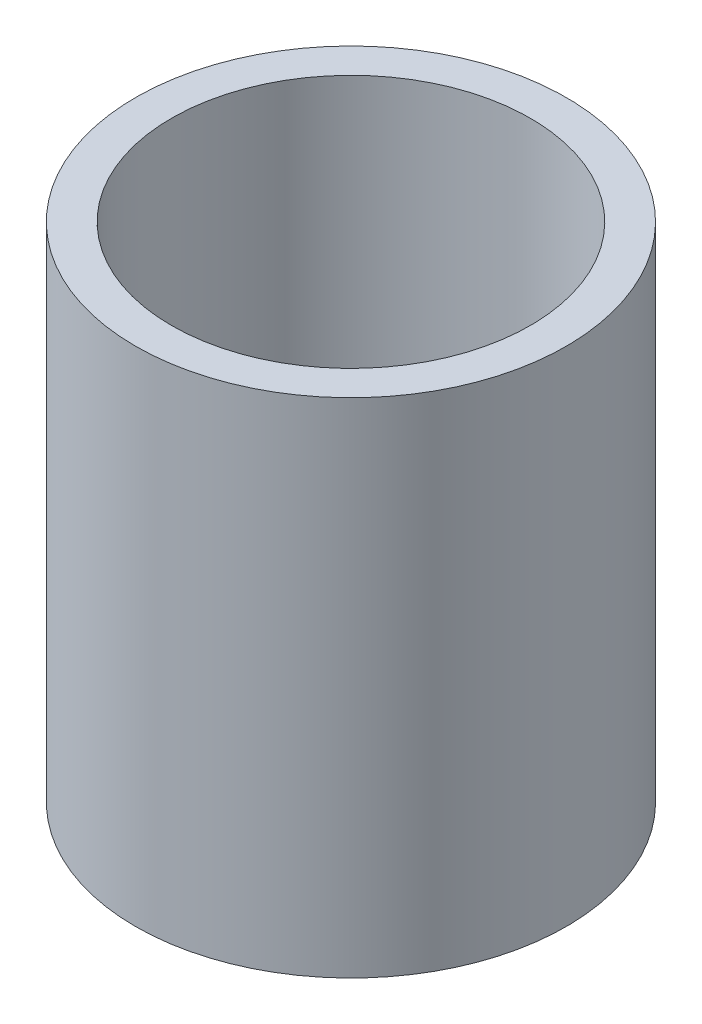
from build123d import *

# Parameters (mm, degrees)
SKETCH1_R           = 76.2
BOSS_EXTRUDE1_DEPTH = 177.8
SHELL1_T            = -12.7
SKETCH2_W           = 0.854807693
SKETCH2_H           = 9.525
SKETCH2_W_2         = 0.854807692
SKETCH2_H_2         = 6.960576923
SKETCH2_H_3         = 9.769230769
SKETCH2_H_4         = 7.326923077
SKETCH2_W_3         = 3.663461538
SKETCH2_H_5         = 0.976923077
BOSS_EXTRUDE2_DEPTH = 12.7


with BuildPart() as part:
    # Sketch1 → Boss-Extrude1 (new body)
    with BuildSketch(Plane(origin=(0, 0, 0), x_dir=(1, 0, 0), z_dir=(0, 1, 0))):
        with Locations(Location((0, 0, 0), (0, 0, 270))):
            Circle(SKETCH1_R)
    extrude(amount=BOSS_EXTRUDE1_DEPTH)

    # Shell1
    shell1_openings = [part.faces().sort_by_distance(p)[0] for p in [
        (0, 177.8, 0),
    ]]
    offset(amount=SHELL1_T, openings=shell1_openings, kind=Kind.INTERSECTION)

    # Sketch2 → Boss-Extrude2 (add)
    # profile 1 of 27: a face of its own
    with BuildSketch(Plane(origin=(0, 12.7, 0), x_dir=(1, 0, 0), z_dir=(0, 1, 0))):
        Polygon((-37.761493015, 26.963192162), (-36.906685323, 26.963192162), (-36.906685323, 23.055499854), (-32.022069938, 23.055499854), (-32.022069938, 26.963192162), (-31.167262246, 26.963192162), (-31.167262246, 17.438192162), (-32.022069938, 17.438192162), (-32.022069938, 22.078576777), (-36.906685323, 22.078576777), (-36.906685323, 17.438192162), (-37.761493015, 17.438192162), align=None)
    # profile 2 of 27: a face of its own
    with BuildSketch(Plane(origin=(0, 12.7, 0), x_dir=(1, 0, 0), z_dir=(0, 1, 0))):
        with Locations((-28.297550708, 22.200692162)):
            Rectangle(SKETCH2_W, SKETCH2_H)
    # profile 3 of 27: a face of its own
    with BuildSketch(Plane(origin=(0, 12.7, 0), x_dir=(1, 0, 0), z_dir=(0, 1, 0))):
        Polygon((-21.76437763, 17.438192162), (-21.76437763, 26.963192162), (-21.585020659, 26.963192162), (-15.292262246, 19.466452378), (-15.292262246, 26.963192162), (-14.437454554, 26.963192162), (-14.437454554, 17.438192162), (-14.632075948, 17.438192162), (-20.909569938, 24.91775947), (-20.909569938, 17.438192162), align=None)
    # profile 4 of 27: a face of its own
    with BuildSketch(Plane(origin=(0, 12.7, 0), x_dir=(1, 0, 0), z_dir=(0, 1, 0))):
        with BuildLine():
            add(Edge.make_bspline(
                [(-11.937905275, 27.329538316), (-11.884861051, 27.32707773), (-11.780990273, 27.322259429), (-11.630785738, 27.280998552), (-11.494014869, 27.211058694), (-11.372699753, 27.117224705), (-11.268599976, 27.006872291), (-11.195718185, 26.878254942), (-11.148875879, 26.739302504), (-11.143219239, 26.642378582), (-11.140339169, 26.593029902)],
                knots=[0, 0, 0, 0, 1.055194115, 2.066272739, 3.074728998, 4.095836921, 5.109056067, 6.073838105, 7.019297344, 8, 8, 8, 8], degree=3))
            add(Edge.make_bspline(
                [(-11.140339169, 26.593029902), (-11.14328419, 26.544962253), (-11.149106147, 26.4499382), (-11.195682004, 26.31339468), (-11.269221094, 26.186564451), (-11.372633, 26.076426304), (-11.494032557, 25.982644188), (-11.630781039, 25.912690577), (-11.780991509, 25.871433346), (-11.884861469, 25.866614543), (-11.937905275, 25.8641537)],
                knots=[0, 0, 0, 0, 0.96129708, 1.900370562, 2.859976407, 3.87933698, 4.906634145, 5.921202961, 6.938410037, 8, 8, 8, 8], degree=3))
            add(Edge.make_bspline(
                [(-11.937905275, 25.8641537), (-11.990342509, 25.866520582), (-12.092404735, 25.871127407), (-12.240360213, 25.913500098), (-12.375964888, 25.982668126), (-12.497516604, 26.075812244), (-12.598835916, 26.187240857), (-12.672582073, 26.313317278), (-12.719050362, 26.449957906), (-12.724886815, 26.544968873), (-12.727839169, 26.593029902)],
                knots=[0, 0, 0, 0, 1.054934014, 2.053291228, 3.073705704, 4.106921865, 5.123545215, 6.088680038, 7.033164197, 8, 8, 8, 8], degree=3))
            add(Edge.make_bspline(
                [(-12.727839169, 26.593029902), (-12.724951497, 26.642371714), (-12.719279929, 26.739282147), (-12.672547241, 26.878333629), (-12.599450193, 27.006190431), (-12.497449516, 27.117838397), (-12.375982742, 27.211034901), (-12.2403556, 27.280189073), (-12.092405954, 27.32256536), (-11.990342923, 27.327171689), (-11.937905275, 27.329538316)],
                knots=[0, 0, 0, 0, 0.98631895, 1.937192651, 2.907499808, 3.917963147, 4.944918757, 5.95915025, 6.951458133, 8, 8, 8, 8], degree=3))
        make_face()
    # profile 5 of 27: a face of its own
    with BuildSketch(Plane(origin=(0, 12.7, 0), x_dir=(1, 0, 0), z_dir=(0, 1, 0))):
        with Locations((-11.934089169, 20.918480624)):
            Rectangle(SKETCH2_W_2, SKETCH2_H_2)
    # profile 6 of 27: a face of its own
    with BuildSketch(Plane(origin=(0, 12.7, 0), x_dir=(1, 0, 0), z_dir=(0, 1, 0))):
        with BuildLine():
            Line((-2.592262246, 22.889499253), (-3.307782078, 22.444922931))
            add(Edge.make_bspline(
                [(-3.307782078, 22.444922931), (-3.386240497, 22.542427346), (-3.540672575, 22.734348232), (-3.808840068, 22.982025264), (-4.094621131, 23.194751285), (-4.402899246, 23.368116493), (-4.733242031, 23.502069154), (-5.084346733, 23.596857071), (-5.456163286, 23.655923617), (-5.711066435, 23.662636938), (-5.841676308, 23.666076777)],
                knots=[0, 0, 0, 0, 1.026593902, 2.0206758, 2.988051866, 3.946915611, 4.916868779, 5.907761954, 6.927957743, 8, 8, 8, 8], degree=3))
            add(Edge.make_bspline(
                [(-5.841676308, 23.666076777), (-5.94606747, 23.663200657), (-6.151663023, 23.657536215), (-6.453486198, 23.622129087), (-6.740984316, 23.55778905), (-7.015959388, 23.473013947), (-7.27645567, 23.359393515), (-7.52315567, 23.221118393), (-7.75824761, 23.060417926), (-7.974918885, 22.874243513), (-8.173117826, 22.671772853), (-8.344837013, 22.454728868), (-8.494343953, 22.229612593), (-8.611653734, 21.990802494), (-8.707652591, 21.743761949), (-8.770808022, 21.483827813), (-8.812894086, 21.214330164), (-8.817709188, 21.030583825), (-8.820146861, 20.937561152)],
                knots=[0, 0, 0, 0, 1.112346261, 2.190735716, 3.231507886, 4.247384806, 5.251966152, 6.253067467, 7.256802811, 8.280671706, 9.291813951, 10.270744147, 11.225547591, 12.165006084, 13.100104208, 14.043489273, 15.009504848, 16, 16, 16, 16], degree=3))
            add(Edge.make_bspline(
                [(-8.820146861, 20.937561152), (-8.815304753, 20.815724942), (-8.805685781, 20.573694159), (-8.730298237, 20.216430182), (-8.606896671, 19.871016425), (-8.438010664, 19.539905281), (-8.224440748, 19.233488329), (-7.973599701, 18.958669071), (-7.685348481, 18.720772595), (-7.362226924, 18.523543794), (-7.011821922, 18.364989644), (-6.637924566, 18.252030402), (-6.243590163, 18.18385216), (-5.973606087, 18.175263486), (-5.83595215, 18.17088447)],
                knots=[0, 0, 0, 0, 0.966302908, 1.919585723, 2.883856336, 3.870342332, 4.860282998, 5.839159637, 6.814385684, 7.815993281, 8.834850808, 9.858348828, 10.908058873, 12, 12, 12, 12], degree=3))
            add(Edge.make_bspline(
                [(-5.83595215, 18.17088447), (-5.709799826, 18.174420958), (-5.461877035, 18.181371097), (-5.09947178, 18.239960633), (-4.754449309, 18.335873665), (-4.426821883, 18.469625484), (-4.117188174, 18.642511081), (-3.827548776, 18.855759967), (-3.552140373, 19.103237429), (-3.390223601, 19.294602765), (-3.307782078, 19.392038316)],
                knots=[0, 0, 0, 0, 1.039848629, 2.043578496, 3.018386758, 3.987534228, 4.954977003, 5.934852016, 6.948509513, 8, 8, 8, 8], degree=3))
            Line((-3.307782078, 19.392038316), (-2.592262246, 18.922657306))
            add(Edge.make_bspline(
                [(-2.592262246, 18.922657306), (-2.634683064, 18.860361828), (-2.7193839, 18.735977638), (-2.860973367, 18.560597578), (-3.01369948, 18.396436428), (-3.176966408, 18.243714238), (-3.348642313, 18.098776342), (-3.534591839, 17.9685517), (-3.728819139, 17.845720504), (-3.933604346, 17.735195473), (-4.146830175, 17.635846127), (-4.368196589, 17.550417298), (-4.596741651, 17.477020081), (-4.832734075, 17.418679873), (-5.076639112, 17.372113949), (-5.327825974, 17.341215661), (-5.58620815, 17.318150789), (-5.760848076, 17.316774108), (-5.84930852, 17.316076777)],
                knots=[0, 0, 0, 0, 0.954134338, 1.905101784, 2.851144739, 3.791306361, 4.734911809, 5.6936923, 6.663572882, 7.643865596, 8.638447847, 9.640600242, 10.646758161, 11.676244097, 12.717260333, 13.78922464, 14.880174919, 16, 16, 16, 16], degree=3))
            add(Edge.make_bspline(
                [(-5.84930852, 17.316076777), (-5.984320996, 17.318502332), (-6.24894643, 17.323256436), (-6.636266968, 17.375530929), (-7.006418448, 17.454337014), (-7.359274408, 17.567449747), (-7.694889781, 17.713059171), (-8.012951625, 17.890923346), (-8.312406788, 18.102519288), (-8.59029399, 18.344080825), (-8.845513497, 18.605992855), (-9.064659772, 18.888612989), (-9.254738687, 19.181550412), (-9.40737693, 19.491274907), (-9.528880351, 19.813669957), (-9.611897074, 20.151318253), (-9.665590146, 20.501436173), (-9.6718042, 20.740194945), (-9.674954554, 20.861239037)],
                knots=[0, 0, 0, 0, 1.1129367, 2.181364009, 3.217532258, 4.231199276, 5.232079859, 6.230262199, 7.231623845, 8.250719726, 9.263571943, 10.242672461, 11.195837495, 12.138959767, 13.085126421, 14.0317438, 15.002148558, 16, 16, 16, 16], degree=3))
            add(Edge.make_bspline(
                [(-9.674954554, 20.861239037), (-9.67375436, 20.943367491), (-9.671366976, 21.106734541), (-9.643984158, 21.349200402), (-9.608609743, 21.588437228), (-9.548668272, 21.821412522), (-9.47943341, 22.051659775), (-9.39105357, 22.276403787), (-9.287379674, 22.496688932), (-9.169672589, 22.711947754), (-9.037169647, 22.918639), (-8.890535719, 23.113911473), (-8.735293633, 23.300110978), (-8.564180785, 23.470809212), (-8.384458584, 23.632832704), (-8.191042368, 23.781853028), (-7.985041514, 23.918308154), (-7.769549758, 24.044721274), (-7.544692508, 24.157278023), (-7.311828926, 24.254251334), (-7.072362182, 24.337125845), (-6.825909219, 24.402736546), (-6.574105847, 24.45775682), (-6.314967778, 24.49236753), (-6.049486373, 24.51682303), (-5.869719625, 24.5195194), (-5.778710563, 24.52088447)],
                knots=[0, 0, 0, 0, 0.990994727, 1.971252077, 2.943264845, 3.907940874, 4.872158414, 5.844625996, 6.82015047, 7.809835459, 8.804511986, 9.781214284, 10.756496977, 11.728388426, 12.696359165, 13.676225489, 14.672885716, 15.677705647, 16.690706858, 17.706033469, 18.721040654, 19.747369689, 20.783475414, 21.830280724, 22.901553713, 24, 24, 24, 24], degree=3))
            add(Edge.make_bspline(
                [(-5.778710563, 24.52088447), (-5.664736841, 24.518375609), (-5.437359089, 24.513370428), (-5.100063309, 24.471246382), (-4.767735532, 24.407737991), (-4.446206629, 24.313650505), (-4.139375043, 24.199721556), (-3.852167853, 24.071779812), (-3.591345856, 23.923204498), (-3.352057203, 23.760680472), (-3.133854374, 23.577362579), (-2.934497505, 23.371059359), (-2.749898516, 23.142844498), (-2.645241323, 22.974644615), (-2.592262246, 22.889499253)],
                knots=[0, 0, 0, 0, 1.095225653, 2.184976855, 3.262915854, 4.344593502, 5.400796181, 6.407717688, 7.363229445, 8.282371371, 9.184954523, 10.097238608, 11.036792983, 12, 12, 12, 12], degree=3))
        make_face()
    # profile 7 of 27: a face of its own
    with BuildSketch(Plane(origin=(0, 12.7, 0), x_dir=(1, 0, 0), z_dir=(0, 1, 0))):
        with BuildLine():
            add(Edge.make_bspline(
                [(2.479342321, 24.52088447), (2.609947143, 24.518103466), (2.866031279, 24.512650597), (3.241065597, 24.454371298), (3.599056288, 24.365251685), (3.941374425, 24.242048362), (4.263635915, 24.076906768), (4.570534801, 23.879850054), (4.861229661, 23.646398853), (5.035463762, 23.46581011), (5.12390362, 23.374144686)],
                knots=[0, 0, 0, 0, 1.054011418, 2.066658804, 3.057071809, 4.030435133, 4.997543892, 5.974964718, 6.972108034, 8, 8, 8, 8], degree=3))
            add(Edge.make_bspline(
                [(5.12390362, 23.374144686), (5.200054509, 23.286476625), (5.350882558, 23.11283712), (5.544282835, 22.831290059), (5.710892938, 22.539715929), (5.844414282, 22.234242847), (5.949692811, 21.917537492), (6.024438742, 21.588511304), (6.068898543, 21.247890916), (6.07489376, 21.016559043), (6.077930062, 20.899400095)],
                knots=[0, 0, 0, 0, 1.025258237, 2.030674902, 3.01204498, 3.988269485, 4.97094183, 5.956517959, 6.965070386, 8, 8, 8, 8], degree=3))
            add(Edge.make_bspline(
                [(6.077930062, 20.899400095), (6.075259422, 20.78156208), (6.069982114, 20.548708669), (6.020061273, 20.205755966), (5.94241596, 19.873211485), (5.831295029, 19.552467468), (5.688806175, 19.242543488), (5.514932232, 18.944793214), (5.308453046, 18.658629195), (5.074399312, 18.386481335), (4.81572242, 18.135657565), (4.535099188, 17.917049917), (4.238044282, 17.729757054), (3.920607727, 17.578890809), (3.585688353, 17.459937981), (3.23256376, 17.376390079), (2.861782533, 17.325875783), (2.608615595, 17.319389059), (2.479342321, 17.316076777)],
                knots=[0, 0, 0, 0, 0.998656419, 1.973391657, 2.932242238, 3.890759089, 4.846373663, 5.82037756, 6.809684879, 7.83454468, 8.860553229, 9.859544525, 10.845671541, 11.83227036, 12.833544569, 13.85385346, 14.904124723, 16, 16, 16, 16], degree=3))
            add(Edge.make_bspline(
                [(2.479342321, 17.316076777), (2.349435692, 17.319400176), (2.095006995, 17.325909219), (1.722917001, 17.376193824), (1.369159539, 17.459899477), (1.03380171, 17.579281725), (0.715000376, 17.729761876), (0.416224267, 17.916483688), (0.135373068, 18.135722397), (-0.123358547, 18.386463768), (-0.357397608, 18.658633721), (-0.563880581, 18.94479204), (-0.73775354, 19.242543794), (-0.880242652, 19.552467387), (-0.991363514, 19.873211507), (-1.069008845, 20.205755961), (-1.118929682, 20.548708671), (-1.124206991, 20.781562081), (-1.12687763, 20.899400095)],
                knots=[0, 0, 0, 0, 1.099876186, 2.154163076, 3.173186993, 4.173200201, 5.163417411, 6.152872554, 7.150605724, 8.17532212, 9.198891216, 10.186952605, 11.159729845, 12.11414092, 13.071450619, 14.029093627, 15.002601286, 16, 16, 16, 16], degree=3))
            add(Edge.make_bspline(
                [(-1.12687763, 20.899400095), (-1.123820622, 21.015922266), (-1.117768269, 21.24661614), (-1.07335317, 21.586596212), (-0.998898812, 21.915065535), (-0.893494083, 22.230548437), (-0.758742028, 22.534682874), (-0.594473095, 22.82697745), (-0.399100016, 23.107251393), (-0.248871848, 23.280666482), (-0.172851188, 23.368420527)],
                knots=[0, 0, 0, 0, 1.031353054, 2.041901799, 3.029428768, 4.008703097, 4.981709435, 5.96992636, 6.972712378, 8, 8, 8, 8], degree=3))
            add(Edge.make_bspline(
                [(-0.172851188, 23.368420527), (-0.084544665, 23.460880898), (0.08912565, 23.642720485), (0.381267545, 23.87549114), (0.687411443, 24.076648455), (1.013234278, 24.238508727), (1.355271199, 24.365976408), (1.715096423, 24.454601131), (2.091403362, 24.512440619), (2.348740616, 24.518041802), (2.479342321, 24.52088447)],
                knots=[0, 0, 0, 0, 1.027980169, 2.021703884, 2.998553061, 3.971491411, 4.943284454, 5.930300938, 6.949603206, 8, 8, 8, 8], degree=3))
        make_face()
        with BuildLine():
            add(Edge.make_bspline(
                [(2.475526216, 23.666076777), (2.383167431, 23.66345171), (2.200834088, 23.658269341), (1.932447932, 23.618852429), (1.674075085, 23.556402436), (1.425225359, 23.467672825), (1.18673794, 23.353103679), (0.958384494, 23.21238307), (0.739493354, 23.04737481), (0.534346453, 22.858337111), (0.346071732, 22.651837847), (0.181485239, 22.431814813), (0.041535485, 22.201836828), (-0.075050947, 21.961664739), (-0.161884081, 21.70886467), (-0.224947806, 21.446299524), (-0.264327532, 21.173434354), (-0.269461177, 20.987939012), (-0.272069938, 20.893675936)],
                knots=[0, 0, 0, 0, 1.021534396, 2.016698045, 2.994645724, 3.958388632, 4.93408049, 5.916473867, 6.921342795, 7.962252576, 8.998418191, 10.008913653, 10.997312074, 11.973003931, 12.956656626, 13.948281152, 14.957379055, 16, 16, 16, 16], degree=3))
            add(Edge.make_bspline(
                [(-0.272069938, 20.893675936), (-0.267697082, 20.771886491), (-0.259017781, 20.530157216), (-0.188436888, 20.174164089), (-0.070364226, 19.832402049), (0.089076871, 19.506874598), (0.288846651, 19.205687898), (0.524215026, 18.937160502), (0.792655925, 18.705333401), (1.0909694, 18.512980528), (1.413062222, 18.360145764), (1.753938353, 18.251835695), (2.109467671, 18.181427732), (2.352438803, 18.174429648), (2.475526216, 18.17088447)],
                knots=[0, 0, 0, 0, 1.016792936, 2.018143844, 3.017858371, 4.030088057, 5.03801393, 6.028138512, 7.003788237, 7.991172063, 8.984598303, 9.972568034, 10.972917682, 12, 12, 12, 12], degree=3))
            add(Edge.make_bspline(
                [(2.475526216, 18.17088447), (2.598606548, 18.174450304), (2.841563706, 18.181489161), (3.196599037, 18.251481092), (3.536543489, 18.36062034), (3.858301765, 18.51280864), (4.15647945, 18.706063854), (4.426850988, 18.935851423), (4.660209708, 19.206399119), (4.859781876, 19.507273537), (5.021834082, 19.831897381), (5.139354082, 20.174227166), (5.210104655, 20.530141151), (5.218761053, 20.771881109), (5.22312237, 20.893675936)],
                knots=[0, 0, 0, 0, 1.02726834, 2.027799167, 3.010890988, 4.004497153, 4.992059811, 5.971914811, 6.958719428, 7.966827853, 8.981595046, 9.981490638, 10.983022906, 12, 12, 12, 12], degree=3))
            add(Edge.make_bspline(
                [(5.22312237, 20.893675936), (5.220514506, 20.987939575), (5.215382629, 21.173436026), (5.175990047, 21.446293132), (5.1129739, 21.70888812), (5.025965428, 21.961578215), (4.909885576, 22.202458673), (4.767237017, 22.431139573), (4.603322584, 22.652600031), (4.412775991, 22.857669582), (4.207843226, 23.047448503), (3.988863372, 23.212447055), (3.760848538, 23.352485226), (3.523053967, 23.46865278), (3.274172336, 23.555595185), (3.016161506, 23.619213018), (2.748920459, 23.658102767), (2.567240491, 23.663401774), (2.475526216, 23.666076777)],
                knots=[0, 0, 0, 0, 1.042956736, 2.052379634, 3.044323526, 4.02829302, 5.004299113, 5.996692471, 7.007513377, 8.048758398, 9.090003419, 10.095195979, 11.07790575, 12.047570684, 13.018257071, 13.989683339, 14.985167495, 16, 16, 16, 16], degree=3))
        make_face(mode=Mode.SUBTRACT)
    # profile 8 of 27: a face of its own
    with BuildSketch(Plane(origin=(0, 12.7, 0), x_dir=(1, 0, 0), z_dir=(0, 1, 0))):
        with Locations((8.092833908, 22.322807547)):
            Rectangle(SKETCH2_W_2, SKETCH2_H_3)
    # profile 9 of 27: a face of its own
    with BuildSketch(Plane(origin=(0, 12.7, 0), x_dir=(1, 0, 0), z_dir=(0, 1, 0))):
        with BuildLine():
            Line((16.186794245, 19.636269085), (16.946199293, 19.237486032))
            add(Edge.make_bspline(
                [(16.946199293, 19.237486032), (16.885683987, 19.130143823), (16.767945167, 18.921298394), (16.565468846, 18.634373116), (16.353218991, 18.376251832), (16.121614621, 18.153830416), (15.877584995, 17.959924861), (15.619776841, 17.790276924), (15.346847987, 17.645718665), (15.058785522, 17.523927857), (14.753170315, 17.430284877), (14.42926176, 17.364142675), (14.086439333, 17.323257923), (13.851454372, 17.318508647), (13.731130182, 17.316076777)],
                knots=[0, 0, 0, 0, 1.120438281, 2.179929193, 3.190490725, 4.156257408, 5.095198341, 6.022838206, 6.959905092, 7.901321166, 8.864066838, 9.862729781, 10.905609505, 12, 12, 12, 12], degree=3))
            add(Edge.make_bspline(
                [(13.731130182, 17.316076777), (13.5973938, 17.319198733), (13.336512863, 17.325288764), (12.956765409, 17.377791828), (12.599225706, 17.463441604), (12.263913856, 17.583090685), (11.951651011, 17.739375046), (11.661816542, 17.929764778), (11.392886261, 18.153281843), (11.153334663, 18.411862307), (10.937678097, 18.688582491), (10.747379972, 18.976933862), (10.588292249, 19.276190923), (10.458881217, 19.584448563), (10.35436512, 19.899763874), (10.281521448, 20.225005796), (10.239530491, 20.559294065), (10.233095821, 20.785437528), (10.229853139, 20.899400095)],
                knots=[0, 0, 0, 0, 1.145258523, 2.234067595, 3.276747158, 4.290159414, 5.277019952, 6.260822364, 7.254936242, 8.264827045, 9.274100331, 10.257902744, 11.220704747, 12.172965371, 13.118907548, 14.062713208, 15.023725156, 16, 16, 16, 16], degree=3))
            add(Edge.make_bspline(
                [(10.229853139, 20.899400095), (10.232735516, 21.006338169), (10.238448008, 21.21827531), (10.274454651, 21.531962256), (10.338267505, 21.836839688), (10.425833073, 22.133160935), (10.538911821, 22.420429857), (10.677248075, 22.698821287), (10.841057332, 22.968038989), (10.967529394, 23.13786466), (11.03123535, 23.223408508)],
                knots=[0, 0, 0, 0, 1.024358464, 2.0301432, 3.019427413, 4.004406732, 4.986367066, 5.972626655, 6.978780325, 8, 8, 8, 8], degree=3))
            add(Edge.make_bspline(
                [(11.03123535, 23.223408508), (11.117525544, 23.326465933), (11.287372477, 23.529316185), (11.574636559, 23.795848343), (11.885696379, 24.019124617), (12.216653733, 24.204201181), (12.571355137, 24.34482732), (12.945032565, 24.449622954), (13.34194091, 24.50834597), (13.613281547, 24.516640432), (13.752118764, 24.52088447)],
                knots=[0, 0, 0, 0, 1.030682036, 2.02871468, 2.997146059, 3.962720338, 4.930598197, 5.918074684, 6.934738563, 8, 8, 8, 8], degree=3))
            add(Edge.make_bspline(
                [(13.752118764, 24.52088447), (13.894851175, 24.517199522), (14.17485963, 24.509970496), (14.583161331, 24.442951688), (14.969497281, 24.33667295), (15.333712882, 24.186575849), (15.67584506, 23.992920212), (15.993669952, 23.753048486), (16.292622997, 23.474324977), (16.46654563, 23.259976529), (16.555048451, 23.150902498)],
                knots=[0, 0, 0, 0, 1.056321875, 2.072262726, 3.055038591, 4.01806755, 4.982017516, 5.957941055, 6.960871419, 8, 8, 8, 8], degree=3))
            add(Edge.make_bspline(
                [(16.555048451, 23.150902498), (16.615265333, 23.068705609), (16.735298276, 22.904858958), (16.885649313, 22.637693166), (17.016161938, 22.35817362), (17.120482353, 22.061782025), (17.204954138, 21.752030168), (17.266068766, 21.426703671), (17.301908943, 21.085899412), (17.308953898, 20.853689287), (17.312545446, 20.735307547)],
                knots=[0, 0, 0, 0, 0.94817472, 1.890038105, 2.849395472, 3.817997239, 4.812318967, 5.836947057, 6.897266129, 8, 8, 8, 8], degree=3))
            Line((17.312545446, 20.735307547), (11.084660831, 20.735307547))
            add(Edge.make_bspline(
                [(11.084660831, 20.735307547), (11.08885076, 20.64359414), (11.097090086, 20.463243426), (11.13550344, 20.199344366), (11.196051889, 19.947956913), (11.281148409, 19.710966635), (11.384200324, 19.485278217), (11.510435739, 19.272565816), (11.661038382, 19.073798306), (11.829020464, 18.887197739), (12.016001916, 18.721025239), (12.21271425, 18.572294334), (12.421974595, 18.447637674), (12.64213295, 18.34645526), (12.872833308, 18.2672445), (13.114148354, 18.213175645), (13.365603228, 18.176961304), (13.537014404, 18.172934501), (13.624279221, 18.17088447)],
                knots=[0, 0, 0, 0, 1.094153842, 2.151609401, 3.174256925, 4.172055639, 5.149267565, 6.128595816, 7.11444997, 8.118368179, 9.117203808, 10.09244225, 11.054858984, 12.015122123, 12.976791628, 13.957293641, 14.960065497, 16, 16, 16, 16], degree=3))
            add(Edge.make_bspline(
                [(13.624279221, 18.17088447), (13.709599129, 18.172539252), (13.878890195, 18.175822659), (14.131005671, 18.207750216), (14.379035385, 18.259376466), (14.621952775, 18.329834225), (14.85482772, 18.415768373), (15.070488825, 18.519462578), (15.268827126, 18.634170103), (15.454202585, 18.76536929), (15.634010074, 18.925955856), (15.812379269, 19.126350211), (16.003632161, 19.363352698), (16.123346696, 19.541730546), (16.186794245, 19.636269085)],
                knots=[0, 0, 0, 0, 0.99110716, 1.966546729, 2.947904876, 3.932708344, 4.903319531, 5.828989031, 6.710028674, 7.56322171, 8.463672341, 9.504779593, 10.677557249, 12, 12, 12, 12], degree=3))
        make_face()
        with BuildLine():
            add(Edge.make_bspline(
                [(16.457737754, 21.590115239), (16.426450512, 21.703497774), (16.366232641, 21.921722655), (16.240403678, 22.223912507), (16.098694699, 22.492484581), (15.930995559, 22.725383439), (15.740988884, 22.932221571), (15.52151878, 23.112975006), (15.275403956, 23.274675355), (15.00391658, 23.4111618), (14.716420008, 23.527339202), (14.415413157, 23.605240409), (14.108278748, 23.658606378), (13.90054044, 23.663576002), (13.79600398, 23.666076777)],
                knots=[0, 0, 0, 0, 1.154881502, 2.222775134, 3.210006277, 4.132804581, 5.035138423, 5.962687519, 6.919655026, 7.923214229, 8.944639381, 9.960483929, 10.97369054, 12, 12, 12, 12], degree=3))
            add(Edge.make_bspline(
                [(13.79600398, 23.666076777), (13.710688722, 23.664412157), (13.542038395, 23.661121552), (13.293569059, 23.629906415), (13.054955021, 23.578308551), (12.824435631, 23.507646776), (12.605031697, 23.413461937), (12.39223022, 23.303017584), (12.191442142, 23.168193703), (12.065871902, 23.065435676), (12.002434269, 23.013522691)],
                knots=[0, 0, 0, 0, 1.04873581, 2.073130211, 3.073294108, 4.04793562, 5.032784715, 6.005352987, 6.992311501, 8, 8, 8, 8], degree=3))
            add(Edge.make_bspline(
                [(12.002434269, 23.013522691), (11.957004694, 22.972444589), (11.865066307, 22.889312522), (11.742219602, 22.746085896), (11.624598173, 22.591640573), (11.517554447, 22.42006777), (11.419371872, 22.233321221), (11.327496506, 22.032976085), (11.244802056, 21.817512067), (11.198276213, 21.667364214), (11.174339317, 21.590115239)],
                knots=[0, 0, 0, 0, 0.879870761, 1.780643979, 2.707998968, 3.669668524, 4.684282772, 5.740141944, 6.837334558, 8, 8, 8, 8], degree=3))
            Line((11.174339317, 21.590115239), (16.457737754, 21.590115239))
        make_face(mode=Mode.SUBTRACT)
    # profile 10 of 27: a face of its own
    with BuildSketch(Plane(origin=(0, 12.7, 0), x_dir=(1, 0, 0), z_dir=(0, 1, 0))):
        with Locations((19.938026216, 23.543961393)):
            Rectangle(SKETCH2_W_2, SKETCH2_H_4)
    # profile 11 of 27: a face of its own
    with BuildSketch(Plane(origin=(0, 12.7, 0), x_dir=(1, 0, 0), z_dir=(0, 1, 0))):
        with BuildLine():
            add(Edge.make_bspline(
                [(19.938026216, 18.903576777), (19.982868664, 18.900433107), (20.071386602, 18.894227576), (20.199434491, 18.850515333), (20.315594388, 18.775843223), (20.417363497, 18.674130993), (20.502783142, 18.553641938), (20.564290496, 18.416880488), (20.604712761, 18.267957407), (20.607980487, 18.163527284), (20.609660831, 18.109826777)],
                knots=[0, 0, 0, 0, 0.932051743, 1.839848197, 2.779380411, 3.780329255, 4.815317283, 5.833513928, 6.885940208, 8, 8, 8, 8], degree=3))
            add(Edge.make_bspline(
                [(20.609660831, 18.109826777), (20.607874475, 18.057414978), (20.604359647, 17.954289715), (20.564382541, 17.806528619), (20.502225842, 17.669575666), (20.41800927, 17.547652558), (20.315587666, 17.445580609), (20.199051591, 17.371565638), (20.071791563, 17.324867317), (19.982934726, 17.31902799), (19.938026216, 17.316076777)],
                knots=[0, 0, 0, 0, 1.089197406, 2.143100788, 3.162726492, 4.210031689, 5.212385385, 6.153236251, 7.066640104, 8, 8, 8, 8], degree=3))
            add(Edge.make_bspline(
                [(19.938026216, 17.316076777), (19.893117706, 17.31902799), (19.804260868, 17.324867317), (19.67700084, 17.371565638), (19.560464766, 17.445580609), (19.458043162, 17.547652558), (19.37382659, 17.669575666), (19.31166989, 17.806528619), (19.271692785, 17.954289715), (19.268177957, 18.057414978), (19.2663916, 18.109826777)],
                knots=[0, 0, 0, 0, 0.933359896, 1.846763749, 2.787614615, 3.789968311, 4.837273508, 5.856899212, 6.910802594, 8, 8, 8, 8], degree=3))
            add(Edge.make_bspline(
                [(19.2663916, 18.109826777), (19.268071944, 18.163527284), (19.271339671, 18.267957407), (19.311761935, 18.416880488), (19.37326929, 18.553641938), (19.458688935, 18.674130993), (19.560458044, 18.775843223), (19.676617941, 18.850515333), (19.804665829, 18.894227576), (19.893183767, 18.900433107), (19.938026216, 18.903576777)],
                knots=[0, 0, 0, 0, 1.114059792, 2.166486072, 3.184682717, 4.219670745, 5.220619589, 6.160151803, 7.067948257, 8, 8, 8, 8], degree=3))
        make_face()
    # profile 12 of 27: a face of its own
    with BuildSketch(Plane(origin=(0, 12.7, 0), x_dir=(1, 0, 0), z_dir=(0, 1, 0))):
        with Locations((-37.334089169, 5.325692162)):
            Rectangle(SKETCH2_W_2, SKETCH2_H)
    # profile 13 of 27: a face of its own
    with BuildSketch(Plane(origin=(0, 12.7, 0), x_dir=(1, 0, 0), z_dir=(0, 1, 0))):
        with Locations((-30.7398584, 5.447807546)):
            Rectangle(SKETCH2_W_2, SKETCH2_H_3)
    # profile 14 of 27: a face of its own
    with BuildSketch(Plane(origin=(0, 12.7, 0), x_dir=(1, 0, 0), z_dir=(0, 1, 0))):
        with BuildLine():
            add(Edge.make_bspline(
                [(-24.996619217, 7.64588447), (-24.866014396, 7.643103466), (-24.60993026, 7.637650597), (-24.234895942, 7.579371298), (-23.876905251, 7.490251685), (-23.534587113, 7.367048362), (-23.212325624, 7.201906768), (-22.905426738, 7.004850054), (-22.614731878, 6.771398853), (-22.440497777, 6.59081011), (-22.352057919, 6.499144686)],
                knots=[0, 0, 0, 0, 1.054011418, 2.066658804, 3.057071809, 4.030435133, 4.997543892, 5.974964718, 6.972108034, 8, 8, 8, 8], degree=3))
            add(Edge.make_bspline(
                [(-22.352057919, 6.499144686), (-22.27590703, 6.411476625), (-22.125078981, 6.23783712), (-21.931678703, 5.956290059), (-21.7650686, 5.664715929), (-21.631547256, 5.359242847), (-21.526268727, 5.042537492), (-21.451522797, 4.713511304), (-21.407062995, 4.372890916), (-21.401067778, 4.141559043), (-21.398031477, 4.024400095)],
                knots=[0, 0, 0, 0, 1.025258237, 2.030674902, 3.01204498, 3.988269485, 4.97094183, 5.956517959, 6.965070386, 8, 8, 8, 8], degree=3))
            add(Edge.make_bspline(
                [(-21.398031477, 4.024400095), (-21.400702116, 3.90656208), (-21.405979424, 3.673708669), (-21.455900266, 3.330755966), (-21.533545578, 2.998211485), (-21.644666509, 2.677467468), (-21.787155364, 2.367543488), (-21.961029306, 2.069793214), (-22.167508493, 1.783629195), (-22.401562227, 1.511481335), (-22.660239118, 1.260657565), (-22.940862351, 1.042049917), (-23.237917257, 0.854757054), (-23.555353811, 0.703890809), (-23.890273186, 0.584937981), (-24.243397778, 0.501390079), (-24.614179005, 0.450875783), (-24.867345944, 0.444389059), (-24.996619217, 0.441076777)],
                knots=[0, 0, 0, 0, 0.998656419, 1.973391657, 2.932242238, 3.890759089, 4.846373663, 5.82037756, 6.809684879, 7.83454468, 8.860553229, 9.859544525, 10.845671541, 11.83227036, 12.833544569, 13.85385346, 14.904124723, 16, 16, 16, 16], degree=3))
            add(Edge.make_bspline(
                [(-24.996619217, 0.441076777), (-25.126525846, 0.444400176), (-25.380954543, 0.450909219), (-25.753044537, 0.501193824), (-26.106802, 0.584899477), (-26.442159829, 0.704281725), (-26.760961162, 0.854761876), (-27.059737272, 1.041483688), (-27.34058847, 1.260722397), (-27.599320085, 1.511463768), (-27.833359147, 1.783633721), (-28.03984212, 2.06979204), (-28.213715079, 2.367543794), (-28.356204191, 2.677467387), (-28.467325053, 2.998211507), (-28.544970384, 3.330755961), (-28.59489122, 3.673708671), (-28.600168529, 3.906562081), (-28.602839169, 4.024400095)],
                knots=[0, 0, 0, 0, 1.099876186, 2.154163076, 3.173186993, 4.173200201, 5.163417411, 6.152872554, 7.150605724, 8.17532212, 9.198891216, 10.186952605, 11.159729845, 12.11414092, 13.071450619, 14.029093627, 15.002601286, 16, 16, 16, 16], degree=3))
            add(Edge.make_bspline(
                [(-28.602839169, 4.024400095), (-28.59978216, 4.140922266), (-28.593729808, 4.37161614), (-28.549314708, 4.711596212), (-28.474860351, 5.040065535), (-28.369455622, 5.355548437), (-28.234703567, 5.659682874), (-28.070434633, 5.95197745), (-27.875061554, 6.232251393), (-27.724833386, 6.405666482), (-27.648812727, 6.493420527)],
                knots=[0, 0, 0, 0, 1.031353054, 2.041901799, 3.029428768, 4.008703097, 4.981709435, 5.96992636, 6.972712378, 8, 8, 8, 8], degree=3))
            add(Edge.make_bspline(
                [(-27.648812727, 6.493420527), (-27.560506204, 6.585880898), (-27.386835889, 6.767720485), (-27.094693994, 7.00049114), (-26.788550095, 7.201648455), (-26.46272726, 7.363508727), (-26.12069034, 7.490976408), (-25.760865115, 7.579601131), (-25.384558177, 7.637440619), (-25.127220922, 7.643041802), (-24.996619217, 7.64588447)],
                knots=[0, 0, 0, 0, 1.027980169, 2.021703884, 2.998553061, 3.971491411, 4.943284454, 5.930300938, 6.949603206, 8, 8, 8, 8], degree=3))
        make_face()
        with BuildLine():
            add(Edge.make_bspline(
                [(-25.000435323, 6.791076777), (-25.092794108, 6.78845171), (-25.275127451, 6.783269341), (-25.543513606, 6.743852429), (-25.801886454, 6.681402436), (-26.05073618, 6.592672825), (-26.289223599, 6.478103679), (-26.517577044, 6.33738307), (-26.736468184, 6.17237481), (-26.941615085, 5.983337111), (-27.129889806, 5.776837847), (-27.294476299, 5.556814813), (-27.434426053, 5.326836828), (-27.551012486, 5.086664739), (-27.637845619, 4.83386467), (-27.700909345, 4.571299524), (-27.74028907, 4.298434354), (-27.745422715, 4.112939012), (-27.748031477, 4.018675936)],
                knots=[0, 0, 0, 0, 1.021534396, 2.016698045, 2.994645724, 3.958388632, 4.93408049, 5.916473867, 6.921342795, 7.962252576, 8.998418191, 10.008913653, 10.997312074, 11.973003931, 12.956656626, 13.948281152, 14.957379055, 16, 16, 16, 16], degree=3))
            add(Edge.make_bspline(
                [(-27.748031477, 4.018675936), (-27.743658621, 3.896886491), (-27.73497932, 3.655157216), (-27.664398426, 3.299164089), (-27.546325765, 2.957402049), (-27.386884668, 2.631874598), (-27.187114887, 2.330687898), (-26.951746513, 2.062160502), (-26.683305614, 1.830333401), (-26.384992138, 1.637980528), (-26.062899316, 1.485145764), (-25.722023185, 1.376835695), (-25.366493868, 1.306427732), (-25.123522735, 1.299429648), (-25.000435323, 1.29588447)],
                knots=[0, 0, 0, 0, 1.016792936, 2.018143844, 3.017858371, 4.030088057, 5.03801393, 6.028138512, 7.003788237, 7.991172063, 8.984598303, 9.972568034, 10.972917682, 12, 12, 12, 12], degree=3))
            add(Edge.make_bspline(
                [(-25.000435323, 1.29588447), (-24.87735499, 1.299450304), (-24.634397833, 1.306489161), (-24.279362501, 1.376481092), (-23.939418049, 1.48562034), (-23.617659773, 1.63780864), (-23.319482088, 1.831063854), (-23.049110551, 2.060851423), (-22.815751831, 2.331399119), (-22.616179663, 2.632273537), (-22.454127456, 2.956897381), (-22.336607457, 3.299227166), (-22.265856884, 3.655141151), (-22.257200486, 3.896881109), (-22.252839169, 4.018675936)],
                knots=[0, 0, 0, 0, 1.02726834, 2.027799167, 3.010890988, 4.004497153, 4.992059811, 5.971914811, 6.958719428, 7.966827853, 8.981595046, 9.981490638, 10.983022906, 12, 12, 12, 12], degree=3))
            add(Edge.make_bspline(
                [(-22.252839169, 4.018675936), (-22.255447032, 4.112939575), (-22.260578909, 4.298436026), (-22.299971491, 4.571293132), (-22.362987638, 4.83388812), (-22.449996111, 5.086578215), (-22.566075963, 5.327458673), (-22.708724521, 5.556139573), (-22.872638955, 5.777600031), (-23.063185548, 5.982669582), (-23.268118312, 6.172448503), (-23.487098166, 6.337447055), (-23.715113001, 6.477485226), (-23.952907572, 6.59365278), (-24.201789202, 6.680595185), (-24.459800033, 6.744213018), (-24.72704108, 6.783102767), (-24.908721047, 6.788401774), (-25.000435323, 6.791076777)],
                knots=[0, 0, 0, 0, 1.042956736, 2.052379634, 3.044323526, 4.02829302, 5.004299113, 5.996692471, 7.007513377, 8.048758398, 9.090003419, 10.095195979, 11.07790575, 12.047570684, 13.018257071, 13.989683339, 14.985167495, 16, 16, 16, 16], degree=3))
        make_face(mode=Mode.SUBTRACT)
    # profile 15 of 27: a face of its own
    with BuildSketch(Plane(origin=(0, 12.7, 0), x_dir=(1, 0, 0), z_dir=(0, 1, 0))):
        Polygon((-20.4211084, 7.523769085), (-19.495702751, 7.523769085), (-17.185050707, 2.455980623), (-14.874398664, 7.523769085), (-13.948993015, 7.523769085), (-17.123993015, 0.563192162), (-17.2461084, 0.563192162), align=None)
    # profile 16 of 27: a face of its own
    with BuildSketch(Plane(origin=(0, 12.7, 0), x_dir=(1, 0, 0), z_dir=(0, 1, 0))):
        with BuildLine():
            Line((-6.770898063, 2.761269085), (-6.011493015, 2.362486032))
            add(Edge.make_bspline(
                [(-6.011493015, 2.362486032), (-6.072008321, 2.255143823), (-6.189747141, 2.046298394), (-6.392223462, 1.759373116), (-6.604473317, 1.501251832), (-6.836077687, 1.278830416), (-7.080107313, 1.084924861), (-7.337915466, 0.915276924), (-7.61084432, 0.770718665), (-7.898906786, 0.648927857), (-8.204521993, 0.555284877), (-8.528430548, 0.489142675), (-8.871252975, 0.448257923), (-9.106237936, 0.443508647), (-9.226562126, 0.441076777)],
                knots=[0, 0, 0, 0, 1.120438281, 2.179929193, 3.190490725, 4.156257408, 5.095198341, 6.022838206, 6.959905092, 7.901321166, 8.864066838, 9.862729781, 10.905609505, 12, 12, 12, 12], degree=3))
            add(Edge.make_bspline(
                [(-9.226562126, 0.441076777), (-9.360298507, 0.444198733), (-9.621179444, 0.450288764), (-10.000926899, 0.502791828), (-10.358466602, 0.588441604), (-10.693778452, 0.708090685), (-11.006041296, 0.864375046), (-11.295875766, 1.054764778), (-11.564806047, 1.278281843), (-11.804357644, 1.536862307), (-12.020014211, 1.813582491), (-12.210312335, 2.101933862), (-12.369400058, 2.401190923), (-12.49881109, 2.709448563), (-12.603327187, 3.024763874), (-12.67617086, 3.350005796), (-12.718161817, 3.684294065), (-12.724596486, 3.910437528), (-12.727839169, 4.024400095)],
                knots=[0, 0, 0, 0, 1.145258523, 2.234067595, 3.276747158, 4.290159414, 5.277019952, 6.260822364, 7.254936242, 8.264827045, 9.274100331, 10.257902744, 11.220704747, 12.172965371, 13.118907548, 14.062713208, 15.023725156, 16, 16, 16, 16], degree=3))
            add(Edge.make_bspline(
                [(-12.727839169, 4.024400095), (-12.724956791, 4.131338169), (-12.7192443, 4.34327531), (-12.683237657, 4.656962256), (-12.619424802, 4.961839688), (-12.531859235, 5.258160935), (-12.418780486, 5.545429857), (-12.280444233, 5.823821287), (-12.116634976, 6.093038989), (-11.990162914, 6.26286466), (-11.926456957, 6.348408508)],
                knots=[0, 0, 0, 0, 1.024358464, 2.0301432, 3.019427413, 4.004406732, 4.986367066, 5.972626655, 6.978780325, 8, 8, 8, 8], degree=3))
            add(Edge.make_bspline(
                [(-11.926456957, 6.348408508), (-11.840166764, 6.451465933), (-11.67031983, 6.654316185), (-11.383055749, 6.920848343), (-11.071995929, 7.144124617), (-10.741038575, 7.329201181), (-10.386337171, 7.46982732), (-10.012659743, 7.574622954), (-9.615751397, 7.63334597), (-9.344410761, 7.641640432), (-9.205573544, 7.64588447)],
                knots=[0, 0, 0, 0, 1.030682036, 2.02871468, 2.997146059, 3.962720338, 4.930598197, 5.918074684, 6.934738563, 8, 8, 8, 8], degree=3))
            add(Edge.make_bspline(
                [(-9.205573544, 7.64588447), (-9.062841132, 7.642199522), (-8.782832677, 7.634970496), (-8.374530976, 7.567951688), (-7.988195026, 7.46167295), (-7.623979425, 7.311575849), (-7.281847247, 7.117920212), (-6.964022355, 6.878048486), (-6.66506931, 6.599324977), (-6.491146678, 6.384976529), (-6.402643856, 6.275902498)],
                knots=[0, 0, 0, 0, 1.056321875, 2.072262726, 3.055038591, 4.01806755, 4.982017516, 5.957941055, 6.960871419, 8, 8, 8, 8], degree=3))
            add(Edge.make_bspline(
                [(-6.402643856, 6.275902498), (-6.342426974, 6.193705609), (-6.222394032, 6.029858958), (-6.072042995, 5.762693166), (-5.94153037, 5.48317362), (-5.837209955, 5.186782025), (-5.752738169, 4.877030168), (-5.691623541, 4.551703671), (-5.655783365, 4.210899412), (-5.64873841, 3.978689287), (-5.645146861, 3.860307547)],
                knots=[0, 0, 0, 0, 0.94817472, 1.890038105, 2.849395472, 3.817997239, 4.812318967, 5.836947057, 6.897266129, 8, 8, 8, 8], degree=3))
            Line((-5.645146861, 3.860307547), (-11.873031477, 3.860307547))
            add(Edge.make_bspline(
                [(-11.873031477, 3.860307547), (-11.868841548, 3.76859414), (-11.860602221, 3.588243426), (-11.822188868, 3.324344366), (-11.761640419, 3.072956913), (-11.676543898, 2.835966635), (-11.573491984, 2.610278217), (-11.447256569, 2.397565816), (-11.296653926, 2.198798306), (-11.128671844, 2.012197739), (-10.941690391, 1.846025239), (-10.744978058, 1.697294334), (-10.535717713, 1.572637674), (-10.315559357, 1.47145526), (-10.084858999, 1.3922445), (-9.843543954, 1.338175645), (-9.59208908, 1.301961304), (-9.420677904, 1.297934501), (-9.333413087, 1.29588447)],
                knots=[0, 0, 0, 0, 1.094153842, 2.151609401, 3.174256925, 4.172055639, 5.149267565, 6.128595816, 7.11444997, 8.118368179, 9.117203808, 10.09244225, 11.054858984, 12.015122123, 12.976791628, 13.957293641, 14.960065497, 16, 16, 16, 16], degree=3))
            add(Edge.make_bspline(
                [(-9.333413087, 1.29588447), (-9.248093178, 1.297539252), (-9.078802112, 1.300822659), (-8.826686636, 1.332750216), (-8.578656922, 1.384376466), (-8.335739532, 1.454834225), (-8.102864587, 1.540768373), (-7.887203483, 1.644462578), (-7.688865182, 1.759170103), (-7.503489723, 1.89036929), (-7.323682234, 2.050955856), (-7.145313039, 2.251350211), (-6.954060146, 2.488352698), (-6.834345612, 2.666730546), (-6.770898063, 2.761269085)],
                knots=[0, 0, 0, 0, 0.99110716, 1.966546729, 2.947904876, 3.932708344, 4.903319531, 5.828989031, 6.710028674, 7.56322171, 8.463672341, 9.504779593, 10.677557249, 12, 12, 12, 12], degree=3))
        make_face()
        with BuildLine():
            add(Edge.make_bspline(
                [(-6.499954554, 4.715115239), (-6.531241796, 4.828497774), (-6.591459667, 5.046722655), (-6.71728863, 5.348912507), (-6.858997608, 5.617484581), (-7.026696749, 5.850383439), (-7.216703423, 6.057221571), (-7.436173528, 6.237975006), (-7.682288352, 6.399675355), (-7.953775728, 6.5361618), (-8.2412723, 6.652339202), (-8.542279151, 6.730240409), (-8.84941356, 6.783606378), (-9.057151867, 6.788576002), (-9.161688328, 6.791076777)],
                knots=[0, 0, 0, 0, 1.154881502, 2.222775134, 3.210006277, 4.132804581, 5.035138423, 5.962687519, 6.919655026, 7.923214229, 8.944639381, 9.960483929, 10.97369054, 12, 12, 12, 12], degree=3))
            add(Edge.make_bspline(
                [(-9.161688328, 6.791076777), (-9.247003585, 6.789412157), (-9.415653913, 6.786121552), (-9.664123249, 6.754906415), (-9.902737286, 6.703308551), (-10.133256676, 6.632646776), (-10.352660611, 6.538461937), (-10.565462087, 6.428017584), (-10.766250166, 6.293193703), (-10.891820405, 6.190435676), (-10.955258039, 6.138522691)],
                knots=[0, 0, 0, 0, 1.04873581, 2.073130211, 3.073294108, 4.04793562, 5.032784715, 6.005352987, 6.992311501, 8, 8, 8, 8], degree=3))
            add(Edge.make_bspline(
                [(-10.955258039, 6.138522691), (-11.000687614, 6.097444589), (-11.092626, 6.014312522), (-11.215472705, 5.871085896), (-11.333094134, 5.716640573), (-11.440137861, 5.54506777), (-11.538320435, 5.358321221), (-11.630195802, 5.157976085), (-11.712890252, 4.942512067), (-11.759416094, 4.792364214), (-11.783352991, 4.715115239)],
                knots=[0, 0, 0, 0, 0.879870761, 1.780643979, 2.707998968, 3.669668524, 4.684282772, 5.740141944, 6.837334558, 8, 8, 8, 8], degree=3))
            Line((-11.783352991, 4.715115239), (-6.499954554, 4.715115239))
        make_face(mode=Mode.SUBTRACT)
    # profile 17 of 27: a face of its own
    with BuildSketch(Plane(origin=(0, 12.7, 0), x_dir=(1, 0, 0), z_dir=(0, 1, 0))):
        Polygon((-1.004762246, 7.523769085), (-0.083172703, 7.523769085), (2.27327261, 2.192669325), (4.665970927, 7.523769085), (5.589468523, 7.523769085), (1.315430062, -2.001230915), (0.391932466, -2.001230915), (1.809615759, 1.156596609), align=None)
    # profile 18 of 27: a face of its own
    with BuildSketch(Plane(origin=(0, 12.7, 0), x_dir=(1, 0, 0), z_dir=(0, 1, 0))):
        with BuildLine():
            add(Edge.make_bspline(
                [(10.050496168, 7.64588447), (10.181100989, 7.643103466), (10.437185125, 7.637650597), (10.812219443, 7.579371298), (11.170210134, 7.490251685), (11.512528271, 7.367048362), (11.834789761, 7.201906768), (12.141688647, 7.004850054), (12.432383507, 6.771398853), (12.606617608, 6.59081011), (12.695057466, 6.499144686)],
                knots=[0, 0, 0, 0, 1.054011418, 2.066658804, 3.057071809, 4.030435133, 4.997543892, 5.974964718, 6.972108034, 8, 8, 8, 8], degree=3))
            add(Edge.make_bspline(
                [(12.695057466, 6.499144686), (12.771208355, 6.411476625), (12.922036404, 6.23783712), (13.115436682, 5.956290059), (13.282046785, 5.664715929), (13.415568128, 5.359242847), (13.520846657, 5.042537492), (13.595592588, 4.713511304), (13.640052389, 4.372890916), (13.646047606, 4.141559043), (13.649083908, 4.024400095)],
                knots=[0, 0, 0, 0, 1.025258237, 2.030674902, 3.01204498, 3.988269485, 4.97094183, 5.956517959, 6.965070386, 8, 8, 8, 8], degree=3))
            add(Edge.make_bspline(
                [(13.649083908, 4.024400095), (13.646413269, 3.90656208), (13.641135961, 3.673708669), (13.591215119, 3.330755966), (13.513569807, 2.998211485), (13.402448876, 2.677467468), (13.259960021, 2.367543488), (13.086086079, 2.069793214), (12.879606892, 1.783629195), (12.645553158, 1.511481335), (12.386876266, 1.260657565), (12.106253034, 1.042049917), (11.809198128, 0.854757054), (11.491761574, 0.703890809), (11.156842199, 0.584937981), (10.803717606, 0.501390079), (10.432936379, 0.450875783), (10.179769441, 0.444389059), (10.050496168, 0.441076777)],
                knots=[0, 0, 0, 0, 0.998656419, 1.973391657, 2.932242238, 3.890759089, 4.846373663, 5.82037756, 6.809684879, 7.83454468, 8.860553229, 9.859544525, 10.845671541, 11.83227036, 12.833544569, 13.85385346, 14.904124723, 16, 16, 16, 16], degree=3))
            add(Edge.make_bspline(
                [(10.050496168, 0.441076777), (9.920589538, 0.444400176), (9.666160841, 0.450909219), (9.294070848, 0.501193824), (8.940313385, 0.584899477), (8.604955556, 0.704281725), (8.286154222, 0.854761876), (7.987378113, 1.041483688), (7.706526914, 1.260722397), (7.447795299, 1.511463768), (7.213756238, 1.783633721), (7.007273265, 2.06979204), (6.833400306, 2.367543794), (6.690911194, 2.677467387), (6.579790332, 2.998211507), (6.502145001, 3.330755961), (6.452224164, 3.673708671), (6.446946855, 3.906562081), (6.444276216, 4.024400095)],
                knots=[0, 0, 0, 0, 1.099876186, 2.154163076, 3.173186993, 4.173200201, 5.163417411, 6.152872554, 7.150605724, 8.17532212, 9.198891216, 10.186952605, 11.159729845, 12.11414092, 13.071450619, 14.029093627, 15.002601286, 16, 16, 16, 16], degree=3))
            add(Edge.make_bspline(
                [(6.444276216, 4.024400095), (6.447333225, 4.140922266), (6.453385577, 4.37161614), (6.497800677, 4.711596212), (6.572255034, 5.040065535), (6.677659763, 5.355548437), (6.812411818, 5.659682874), (6.976680752, 5.95197745), (7.17205383, 6.232251393), (7.322281998, 6.405666482), (7.398302658, 6.493420527)],
                knots=[0, 0, 0, 0, 1.031353054, 2.041901799, 3.029428768, 4.008703097, 4.981709435, 5.96992636, 6.972712378, 8, 8, 8, 8], degree=3))
            add(Edge.make_bspline(
                [(7.398302658, 6.493420527), (7.486609181, 6.585880898), (7.660279496, 6.767720485), (7.952421391, 7.00049114), (8.25856529, 7.201648455), (8.584388124, 7.363508727), (8.926425045, 7.490976408), (9.286250269, 7.579601131), (9.662557208, 7.637440619), (9.919894462, 7.643041802), (10.050496168, 7.64588447)],
                knots=[0, 0, 0, 0, 1.027980169, 2.021703884, 2.998553061, 3.971491411, 4.943284454, 5.930300938, 6.949603206, 8, 8, 8, 8], degree=3))
        make_face()
        with BuildLine():
            add(Edge.make_bspline(
                [(10.046680062, 6.791076777), (9.954321277, 6.78845171), (9.771987934, 6.783269341), (9.503601778, 6.743852429), (9.245228931, 6.681402436), (8.996379205, 6.592672825), (8.757891786, 6.478103679), (8.529538341, 6.33738307), (8.310647201, 6.17237481), (8.1055003, 5.983337111), (7.917225579, 5.776837847), (7.752639085, 5.556814813), (7.612689331, 5.326836828), (7.496102899, 5.086664739), (7.409269766, 4.83386467), (7.34620604, 4.571299524), (7.306826314, 4.298434354), (7.30169267, 4.112939012), (7.299083908, 4.018675936)],
                knots=[0, 0, 0, 0, 1.021534396, 2.016698045, 2.994645724, 3.958388632, 4.93408049, 5.916473867, 6.921342795, 7.962252576, 8.998418191, 10.008913653, 10.997312074, 11.973003931, 12.956656626, 13.948281152, 14.957379055, 16, 16, 16, 16], degree=3))
            add(Edge.make_bspline(
                [(7.299083908, 4.018675936), (7.303456764, 3.896886491), (7.312136065, 3.655157216), (7.382716958, 3.299164089), (7.50078962, 2.957402049), (7.660230717, 2.631874598), (7.860000498, 2.330687898), (8.095368872, 2.062160502), (8.363809771, 1.830333401), (8.662123246, 1.637980528), (8.984216069, 1.485145764), (9.3250922, 1.376835695), (9.680621517, 1.306427732), (9.92359265, 1.299429648), (10.046680062, 1.29588447)],
                knots=[0, 0, 0, 0, 1.016792936, 2.018143844, 3.017858371, 4.030088057, 5.03801393, 6.028138512, 7.003788237, 7.991172063, 8.984598303, 9.972568034, 10.972917682, 12, 12, 12, 12], degree=3))
            add(Edge.make_bspline(
                [(10.046680062, 1.29588447), (10.169760394, 1.299450304), (10.412717552, 1.306489161), (10.767752883, 1.376481092), (11.107697335, 1.48562034), (11.429455611, 1.63780864), (11.727633296, 1.831063854), (11.998004834, 2.060851423), (12.231363554, 2.331399119), (12.430935722, 2.632273537), (12.592987929, 2.956897381), (12.710507928, 3.299227166), (12.781258501, 3.655141151), (12.789914899, 3.896881109), (12.794276216, 4.018675936)],
                knots=[0, 0, 0, 0, 1.02726834, 2.027799167, 3.010890988, 4.004497153, 4.992059811, 5.971914811, 6.958719428, 7.966827853, 8.981595046, 9.981490638, 10.983022906, 12, 12, 12, 12], degree=3))
            add(Edge.make_bspline(
                [(12.794276216, 4.018675936), (12.791668352, 4.112939575), (12.786536475, 4.298436026), (12.747143894, 4.571293132), (12.684127746, 4.83388812), (12.597119274, 5.086578215), (12.481039422, 5.327458673), (12.338390863, 5.556139573), (12.17447643, 5.777600031), (11.983929837, 5.982669582), (11.778997073, 6.172448503), (11.560017219, 6.337447055), (11.332002384, 6.477485226), (11.094207813, 6.59365278), (10.845326182, 6.680595185), (10.587315352, 6.744213018), (10.320074305, 6.783102767), (10.138394338, 6.788401774), (10.046680062, 6.791076777)],
                knots=[0, 0, 0, 0, 1.042956736, 2.052379634, 3.044323526, 4.02829302, 5.004299113, 5.996692471, 7.007513377, 8.048758398, 9.090003419, 10.095195979, 11.07790575, 12.047570684, 13.018257071, 13.989683339, 14.985167495, 16, 16, 16, 16], degree=3))
        make_face(mode=Mode.SUBTRACT)
    # profile 19 of 27: a face of its own
    with BuildSketch(Plane(origin=(0, 12.7, 0), x_dir=(1, 0, 0), z_dir=(0, 1, 0))):
        with BuildLine():
            Line((15.236583908, 7.523769085), (16.0913916, 7.523769085))
            Line((16.0913916, 7.523769085), (16.0913916, 4.295343604))
            add(Edge.make_bspline(
                [(16.0913916, 4.295343604), (16.091777784, 4.20057598), (16.092516536, 4.019289953), (16.097526526, 3.758426909), (16.109310566, 3.52052857), (16.124043903, 3.305457507), (16.142990859, 3.113250106), (16.165533433, 2.944577713), (16.190729566, 2.797527541), (16.215393095, 2.708963123), (16.226863355, 2.667774494)],
                knots=[0, 0, 0, 0, 1.388932606, 2.656963016, 3.823490214, 4.879454478, 5.816252168, 6.653371382, 7.373723809, 8, 8, 8, 8], degree=3))
            add(Edge.make_bspline(
                [(16.226863355, 2.667774494), (16.245264172, 2.616005109), (16.281683257, 2.513542613), (16.347741809, 2.36552682), (16.429461783, 2.228434087), (16.518887457, 2.096978004), (16.622027988, 1.975052596), (16.737578405, 1.862863762), (16.861670751, 1.756172628), (17.046061207, 1.62993973), (17.298226781, 1.49464301), (17.629296065, 1.377905104), (17.988263994, 1.308139051), (18.236362266, 1.300044828), (18.363882586, 1.29588447)],
                knots=[0, 0, 0, 0, 0.725840625, 1.436591201, 2.137033971, 2.831655856, 3.53531722, 4.242432219, 4.957935707, 5.694543706, 7.190802206, 8.724350549, 10.316345118, 12, 12, 12, 12], degree=3))
            add(Edge.make_bspline(
                [(18.363882586, 1.29588447), (18.49139106, 1.300133296), (18.738096366, 1.308353989), (19.093120247, 1.375800619), (19.417654453, 1.488483245), (19.708441685, 1.645801987), (19.964163007, 1.838321458), (20.17726289, 2.064224001), (20.353086918, 2.31636269), (20.429856842, 2.504479477), (20.468464918, 2.59908459)],
                knots=[0, 0, 0, 0, 1.157059328, 2.238695713, 3.266970494, 4.264342957, 5.228770407, 6.160125903, 7.074715775, 8, 8, 8, 8], degree=3))
            add(Edge.make_bspline(
                [(20.468464918, 2.59908459), (20.479879215, 2.637092874), (20.505113439, 2.721119908), (20.532225267, 2.863667652), (20.556648624, 3.033660611), (20.57750341, 3.232211165), (20.59237646, 3.458800444), (20.600393861, 3.713357637), (20.609451524, 3.995083624), (20.609589, 4.192299455), (20.609660831, 4.295343604)],
                knots=[0, 0, 0, 0, 0.557542046, 1.232589297, 2.036731608, 2.971723315, 4.038036528, 5.22795436, 6.551621927, 8, 8, 8, 8], degree=3))
            Line((20.609660831, 4.295343604), (20.609660831, 7.523769085))
            Line((20.609660831, 7.523769085), (21.464468523, 7.523769085))
            Line((21.464468523, 7.523769085), (21.464468523, 4.135067162))
            add(Edge.make_bspline(
                [(21.464468523, 4.135067162), (21.463266483, 4.019931217), (21.460934359, 3.796551734), (21.445946517, 3.471928544), (21.420230071, 3.169408435), (21.381197478, 2.888831272), (21.335298749, 2.630411269), (21.276090607, 2.393817219), (21.205392688, 2.179778076), (21.125639822, 1.984537954), (21.031418883, 1.807517478), (20.931196777, 1.639507863), (20.815468648, 1.484677804), (20.693629653, 1.335319987), (20.558098004, 1.198863402), (20.411413388, 1.072176886), (20.255640395, 0.953323849), (20.087322221, 0.846939725), (19.908916078, 0.75110014), (19.720201725, 0.666147813), (19.518867722, 0.598921514), (19.307511682, 0.540926059), (19.085098089, 0.495438825), (18.851841363, 0.463362526), (18.607820071, 0.443699304), (18.441515042, 0.441965632), (18.356250374, 0.441076777)],
                knots=[0, 0, 0, 0, 1.493040784, 2.896703357, 4.213163133, 5.428574705, 6.569057535, 7.615249723, 8.588095153, 9.490268104, 10.346124644, 11.18633936, 12.024365274, 12.850166724, 13.684164916, 14.514361689, 15.362232829, 16.222528818, 17.093394965, 17.986930858, 18.902426812, 19.842810585, 20.827885679, 21.843828298, 22.894529745, 24, 24, 24, 24], degree=3))
            add(Edge.make_bspline(
                [(18.356250374, 0.441076777), (18.271623432, 0.442001266), (18.105323613, 0.443817972), (17.861289727, 0.463253892), (17.627386734, 0.495388985), (17.404446221, 0.541259255), (17.192244469, 0.598515581), (16.98992193, 0.666560917), (16.799847662, 0.751144228), (16.619738066, 0.846333152), (16.451002995, 0.954007223), (16.29286465, 1.072030245), (16.145535073, 1.200226031), (16.008981766, 1.338059196), (15.885121451, 1.487239573), (15.772410652, 1.646567133), (15.66911419, 1.814463189), (15.575625525, 1.994249367), (15.495311391, 2.191748907), (15.4244039, 2.410271722), (15.36640852, 2.652213571), (15.319212231, 2.917367605), (15.281244382, 3.204464825), (15.254884238, 3.515166013), (15.240145441, 3.848714346), (15.237796681, 4.079082976), (15.236583908, 4.198032907)],
                knots=[0, 0, 0, 0, 1.083640291, 2.129454052, 3.13281866, 4.105697902, 5.042300162, 5.946461698, 6.836384745, 7.703652036, 8.553297018, 9.397182691, 10.228592656, 11.052265423, 11.879314572, 12.708807002, 13.549817954, 14.402308542, 15.300838682, 16.27712199, 17.341985831, 18.484375296, 19.725102775, 21.0496083, 22.476576903, 24, 24, 24, 24], degree=3))
            Line((15.236583908, 4.198032907), (15.236583908, 7.523769085))
        make_face()
    # profile 20 of 27: a face of its own
    with BuildSketch(Plane(origin=(0, 12.7, 0), x_dir=(1, 0, 0), z_dir=(0, 1, 0))):
        with Locations((24.334180062, 6.668961392)):
            Rectangle(SKETCH2_W_2, SKETCH2_H_4)
    # profile 21 of 27: a face of its own
    with BuildSketch(Plane(origin=(0, 12.7, 0), x_dir=(1, 0, 0), z_dir=(0, 1, 0))):
        with BuildLine():
            add(Edge.make_bspline(
                [(24.334180062, 2.028576777), (24.37902251, 2.025433107), (24.467540448, 2.019227576), (24.595588337, 1.975515333), (24.711748234, 1.900843223), (24.813517343, 1.799130993), (24.898936988, 1.678641938), (24.960444343, 1.541880488), (25.000866607, 1.392957407), (25.004134333, 1.288527284), (25.005814677, 1.234826777)],
                knots=[0, 0, 0, 0, 0.932051743, 1.839848197, 2.779380411, 3.780329255, 4.815317283, 5.833513928, 6.885940208, 8, 8, 8, 8], degree=3))
            add(Edge.make_bspline(
                [(25.005814677, 1.234826777), (25.004028321, 1.182414978), (25.000513493, 1.079289715), (24.960536387, 0.931528619), (24.898379688, 0.794575666), (24.814163116, 0.672652558), (24.711741512, 0.570580609), (24.595205437, 0.496565638), (24.467945409, 0.449867317), (24.379088572, 0.44402799), (24.334180062, 0.441076777)],
                knots=[0, 0, 0, 0, 1.089197406, 2.143100788, 3.162726492, 4.210031689, 5.212385385, 6.153236251, 7.066640104, 8, 8, 8, 8], degree=3))
            add(Edge.make_bspline(
                [(24.334180062, 0.441076777), (24.289271552, 0.44402799), (24.200414715, 0.449867317), (24.073154686, 0.496565638), (23.956618612, 0.570580609), (23.854197008, 0.672652558), (23.769980436, 0.794575666), (23.707823736, 0.931528619), (23.667846631, 1.079289715), (23.664331803, 1.182414978), (23.662545446, 1.234826777)],
                knots=[0, 0, 0, 0, 0.933359896, 1.846763749, 2.787614615, 3.789968311, 4.837273508, 5.856899212, 6.910802594, 8, 8, 8, 8], degree=3))
            add(Edge.make_bspline(
                [(23.662545446, 1.234826777), (23.664225791, 1.288527284), (23.667493517, 1.392957407), (23.707915781, 1.541880488), (23.769423136, 1.678641938), (23.854842781, 1.799130993), (23.95661189, 1.900843223), (24.072771787, 1.975515333), (24.200819676, 2.019227576), (24.289337613, 2.025433107), (24.334180062, 2.028576777)],
                knots=[0, 0, 0, 0, 1.114059792, 2.166486072, 3.184682717, 4.219670745, 5.220619589, 6.160151803, 7.067948257, 8, 8, 8, 8], degree=3))
        make_face()
    # profile 22 of 27: a face of its own
    with BuildSketch(Plane(origin=(0, 12.7, 0), x_dir=(1, 0, 0), z_dir=(0, 1, 0))):
        with Locations((-36.784569938, -29.5233463)):
            Rectangle(SKETCH2_W_3, SKETCH2_H_5)
    # profile 23 of 27: a face of its own
    with BuildSketch(Plane(origin=(0, 12.7, 0), x_dir=(1, 0, 0), z_dir=(0, 1, 0))):
        with BuildLine():
            Line((-34.342262246, -31.34935291), (-33.537063929, -30.86661553))
            add(Edge.make_bspline(
                [(-33.537063929, -30.86661553), (-33.462175011, -30.991976464), (-33.318690736, -31.232163174), (-33.079337395, -31.556715413), (-32.831325686, -31.832565282), (-32.572819, -32.05810805), (-32.305395241, -32.235678235), (-32.027308638, -32.361414308), (-31.73949631, -32.439834927), (-31.543624696, -32.449360162), (-31.445837967, -32.45411553)],
                knots=[0, 0, 0, 0, 1.272034388, 2.437168799, 3.508375237, 4.49857839, 5.41946034, 6.295179144, 7.148887113, 8, 8, 8, 8], degree=3))
            add(Edge.make_bspline(
                [(-31.445837967, -32.45411553), (-31.362325868, -32.4517896), (-31.196762936, -32.447178438), (-30.953025689, -32.402871398), (-30.716310927, -32.334802676), (-30.49149742, -32.23731857), (-30.281687212, -32.119375976), (-30.097700419, -31.976919593), (-29.938643497, -31.81742699), (-29.808534407, -31.639492766), (-29.708712311, -31.448129669), (-29.63198961, -31.251707973), (-29.58941266, -31.047142083), (-29.582998924, -30.909409324), (-29.579762246, -30.83990279)],
                knots=[0, 0, 0, 0, 1.095163259, 2.171163733, 3.241058638, 4.321873601, 5.38011039, 6.391990106, 7.366004449, 8.327778327, 9.272591725, 10.192022065, 11.087607919, 12, 12, 12, 12], degree=3))
            add(Edge.make_bspline(
                [(-29.579762246, -30.83990279), (-29.583774477, -30.760598049), (-29.591930757, -30.599383099), (-29.660868571, -30.361531187), (-29.769315449, -30.126147835), (-29.869362358, -29.980547963), (-29.921303712, -29.904956877)],
                knots=[0, 0, 0, 0, 0.938893495, 1.908633276, 2.914225137, 4, 4, 4, 4], degree=3))
            add(Edge.make_bspline(
                [(-29.921303712, -29.904956877), (-29.963950169, -29.850400878), (-30.053481072, -29.735867383), (-30.207398302, -29.56538285), (-30.388008942, -29.389528438), (-30.589132188, -29.201589147), (-30.81809438, -29.010305929), (-31.067724258, -28.806557259), (-31.344395189, -28.598091538), (-31.538431676, -28.458284771), (-31.638551308, -28.38614678)],
                knots=[0, 0, 0, 0, 0.722233717, 1.516239348, 2.393582979, 3.351407094, 4.387010283, 5.505090956, 6.712668013, 8, 8, 8, 8], degree=3))
            add(Edge.make_bspline(
                [(-31.638551308, -28.38614678), (-31.738765184, -28.314767553), (-31.930366482, -28.178295905), (-32.198314481, -27.975755532), (-32.437921198, -27.790579001), (-32.648121665, -27.621023082), (-32.828823425, -27.46706478), (-32.981450422, -27.330182531), (-33.102114638, -27.206674412), (-33.16921304, -27.126551903), (-33.199338568, -27.090578872)],
                knots=[0, 0, 0, 0, 1.452282411, 2.77665338, 3.964542531, 5.026858415, 5.96415736, 6.766646006, 7.446254459, 8, 8, 8, 8], degree=3))
            add(Edge.make_bspline(
                [(-33.199338568, -27.090578872), (-33.241445995, -27.034514621), (-33.3242559, -26.924256749), (-33.433564815, -26.751922672), (-33.526472108, -26.575510785), (-33.599303883, -26.39454704), (-33.660634593, -26.211571983), (-33.701885819, -26.024198236), (-33.727715978, -25.833266567), (-33.73036117, -25.704778398), (-33.731685323, -25.640458679)],
                knots=[0, 0, 0, 0, 1.068054152, 2.10047183, 3.106115577, 4.101338837, 5.06977816, 6.043150881, 7.020423561, 8, 8, 8, 8], degree=3))
            add(Edge.make_bspline(
                [(-33.731685323, -25.640458679), (-33.72813329, -25.539684793), (-33.721105146, -25.340290991), (-33.661667738, -25.049014231), (-33.56785222, -24.770921196), (-33.436421133, -24.508765073), (-33.266992194, -24.269371939), (-33.070924221, -24.049988093), (-32.83739439, -23.865560737), (-32.581164751, -23.704419349), (-32.300704196, -23.578292224), (-32.006814666, -23.483148414), (-31.699029063, -23.429238934), (-31.490559103, -23.421502552), (-31.384780275, -23.417577069)],
                knots=[0, 0, 0, 0, 1.005424448, 1.989358655, 2.955360095, 3.929531133, 4.905563448, 5.876582895, 6.856512386, 7.866279853, 8.892233794, 9.918561126, 10.94386622, 12, 12, 12, 12], degree=3))
            add(Edge.make_bspline(
                [(-31.384780275, -23.417577069), (-31.272537402, -23.421448441), (-31.049322152, -23.429147366), (-30.720983929, -23.49608779), (-30.404860837, -23.606851761), (-30.150561666, -23.732550895), (-29.951536079, -23.858094248), (-29.799754571, -23.972448198), (-29.645946366, -24.104097601), (-29.488870802, -24.25339312), (-29.331189436, -24.421704636), (-29.170561327, -24.607879439), (-29.006610853, -24.810779781), (-28.901139548, -24.955626458), (-28.847069938, -25.029881756)],
                knots=[0, 0, 0, 0, 1.286793592, 2.559021753, 3.825965368, 5.121522368, 5.803751409, 6.523245864, 7.299691795, 8.125521123, 9.008227632, 9.944561021, 10.946284179, 12, 12, 12, 12], degree=3))
            Line((-28.847069938, -25.029881756), (-29.619831356, -25.615653992))
            add(Edge.make_bspline(
                [(-29.619831356, -25.615653992), (-29.666492787, -25.555541199), (-29.756351792, -25.439778014), (-29.89277561, -25.277658934), (-30.02135943, -25.129568371), (-30.148043018, -25.000939702), (-30.266135687, -24.884728896), (-30.380754209, -24.785234129), (-30.490249122, -24.701480544), (-30.628271572, -24.612099142), (-30.801674791, -24.523498943), (-31.019346993, -24.448526095), (-31.24682107, -24.403472676), (-31.401750996, -24.397515775), (-31.480182919, -24.394500146)],
                knots=[0, 0, 0, 0, 1.181633172, 2.275549214, 3.290209073, 4.226197932, 5.078386478, 5.862611352, 6.581680152, 7.217281963, 8.414376989, 9.595101626, 10.782541182, 12, 12, 12, 12], degree=3))
            add(Edge.make_bspline(
                [(-31.480182919, -24.394500146), (-31.578580312, -24.397797701), (-31.768330415, -24.404156725), (-32.037725272, -24.473607542), (-32.280188025, -24.582959604), (-32.488520363, -24.736216795), (-32.661975994, -24.917793211), (-32.787448706, -25.12674138), (-32.862968797, -25.357470633), (-32.872184315, -25.518420427), (-32.87687763, -25.600389569)],
                knots=[0, 0, 0, 0, 1.14458467, 2.207223713, 3.21896685, 4.227309161, 5.202851033, 6.127160689, 7.046193047, 8, 8, 8, 8], degree=3))
            add(Edge.make_bspline(
                [(-32.87687763, -25.600389569), (-32.875807764, -25.651420378), (-32.873666283, -25.753565443), (-32.843799155, -25.904472527), (-32.805428838, -26.054998386), (-32.744624962, -26.204466272), (-32.660681671, -26.355490207), (-32.550449728, -26.510670792), (-32.411620643, -26.671375799), (-32.305275345, -26.775898724), (-32.249128231, -26.831083679)],
                knots=[0, 0, 0, 0, 0.858281714, 1.717966888, 2.583508476, 3.4729293, 4.427298488, 5.488583878, 6.674047936, 8, 8, 8, 8], degree=3))
            add(Edge.make_bspline(
                [(-32.249128231, -26.831083679), (-32.228278354, -26.849690157), (-32.178743817, -26.893894888), (-32.088185762, -26.96626388), (-31.968598575, -27.055534282), (-31.823105013, -27.165989765), (-31.649022407, -27.294118601), (-31.446331615, -27.438282503), (-31.217292015, -27.603161502), (-31.054763087, -27.718434523), (-30.968824746, -27.779385963)],
                knots=[0, 0, 0, 0, 0.420754252, 0.999615792, 1.744751191, 2.668019286, 3.750313428, 4.999500688, 6.413464383, 8, 8, 8, 8], degree=3))
            add(Edge.make_bspline(
                [(-30.968824746, -27.779385963), (-30.865448796, -27.854609949), (-30.665275597, -28.000270771), (-30.380457469, -28.2191163), (-30.122210748, -28.433150585), (-29.889628744, -28.641006787), (-29.680413729, -28.84110824), (-29.496886789, -29.035862324), (-29.337177902, -29.223873775), (-29.165240172, -29.464917713), (-28.989550677, -29.760957664), (-28.838670575, -30.12366487), (-28.743533929, -30.487782), (-28.731092876, -30.732511462), (-28.724954554, -30.85325916)],
                knots=[0, 0, 0, 0, 1.163667725, 2.253281268, 3.268753668, 4.215851969, 5.092017293, 5.902905408, 6.650798638, 7.335211899, 8.59617414, 9.77448103, 10.901945474, 12, 12, 12, 12], degree=3))
            add(Edge.make_bspline(
                [(-28.724954554, -30.85325916), (-28.726742908, -30.93865314), (-28.730284888, -31.107782805), (-28.770999946, -31.356126978), (-28.83065275, -31.597329559), (-28.920561222, -31.828409087), (-29.030297817, -32.053593048), (-29.169543106, -32.266974548), (-29.330944733, -32.473276247), (-29.516093765, -32.666997035), (-29.718692971, -32.844832039), (-29.932825025, -33.003026128), (-30.158840411, -33.134929208), (-30.39551303, -33.242564), (-30.642897246, -33.326747358), (-30.900909858, -33.387742381), (-31.169976171, -33.425177565), (-31.352857481, -33.429063116), (-31.445837967, -33.431038607)],
                knots=[0, 0, 0, 0, 0.983748083, 1.948392443, 2.894712957, 3.844097841, 4.80183111, 5.778335162, 6.776009319, 7.81870978, 8.863265674, 9.881300176, 10.883814829, 11.87499822, 12.874611388, 13.892143829, 14.928324115, 16, 16, 16, 16], degree=3))
            add(Edge.make_bspline(
                [(-31.445837967, -33.431038607), (-31.517779865, -33.429647463), (-31.660757626, -33.426882695), (-31.87223843, -33.402440782), (-32.079446884, -33.367859307), (-32.279782894, -33.312957016), (-32.475827564, -33.246344672), (-32.666728253, -33.164325352), (-32.852577478, -33.066034968), (-33.034416757, -32.953653508), (-33.211783618, -32.822867789), (-33.383014455, -32.670539917), (-33.553727453, -32.500871078), (-33.718883867, -32.309253759), (-33.881824353, -32.098783691), (-34.03933631, -31.867491699), (-34.194680128, -31.616637615), (-34.292149365, -31.440111917), (-34.342262246, -31.34935291)],
                knots=[0, 0, 0, 0, 0.915332311, 1.819136955, 2.706846663, 3.586547465, 4.459518054, 5.340707479, 6.227863349, 7.133153174, 8.059268498, 9.028702269, 10.047606654, 11.120612155, 12.245963614, 13.433783089, 14.680604001, 16, 16, 16, 16], degree=3))
        make_face()
    # profile 24 of 27: a face of its own
    with BuildSketch(Plane(origin=(0, 12.7, 0), x_dir=(1, 0, 0), z_dir=(0, 1, 0))):
        Polygon((-26.160531477, -23.417577069), (-25.305723784, -23.417577069), (-25.305723784, -26.226230915), (-24.084569938, -26.226230915), (-24.084569938, -27.081038607), (-25.305723784, -27.081038607), (-25.305723784, -33.186807838), (-26.160531477, -33.186807838), (-26.160531477, -27.081038607), (-27.381685323, -27.081038607), (-27.381685323, -26.226230915), (-26.160531477, -26.226230915), align=None)
    # profile 25 of 27: a face of its own
    with BuildSketch(Plane(origin=(0, 12.7, 0), x_dir=(1, 0, 0), z_dir=(0, 1, 0))):
        with BuildLine():
            Line((-16.906474986, -30.988730915), (-16.147069938, -31.387513968))
            add(Edge.make_bspline(
                [(-16.147069938, -31.387513968), (-16.207585244, -31.494856177), (-16.325324064, -31.703701606), (-16.527800385, -31.990626884), (-16.74005024, -32.248748168), (-16.97165461, -32.471169584), (-17.215684236, -32.665075139), (-17.473492389, -32.834723076), (-17.746421243, -32.979281335), (-18.034483709, -33.101072143), (-18.340098916, -33.194715123), (-18.664007471, -33.260857325), (-19.006829898, -33.301742077), (-19.241814859, -33.306491353), (-19.362139049, -33.308923223)],
                knots=[0, 0, 0, 0, 1.120438281, 2.179929193, 3.190490725, 4.156257408, 5.095198341, 6.022838206, 6.959905092, 7.901321166, 8.864066838, 9.862729781, 10.905609505, 12, 12, 12, 12], degree=3))
            add(Edge.make_bspline(
                [(-19.362139049, -33.308923223), (-19.49587543, -33.305801267), (-19.756756368, -33.299711236), (-20.136503822, -33.247208172), (-20.494043525, -33.161558396), (-20.829355375, -33.041909315), (-21.141618219, -32.885624954), (-21.431452689, -32.695235222), (-21.70038297, -32.471718157), (-21.939934568, -32.213137693), (-22.155591134, -31.936417509), (-22.345889258, -31.648066138), (-22.504976982, -31.348809077), (-22.634388014, -31.040551437), (-22.73890411, -30.725236126), (-22.811747783, -30.399994204), (-22.85373874, -30.065705935), (-22.860173409, -29.839562472), (-22.863416092, -29.725599905)],
                knots=[0, 0, 0, 0, 1.145258523, 2.234067595, 3.276747158, 4.290159414, 5.277019952, 6.260822364, 7.254936242, 8.264827045, 9.274100331, 10.257902744, 11.220704747, 12.172965371, 13.118907548, 14.062713208, 15.023725156, 16, 16, 16, 16], degree=3))
            add(Edge.make_bspline(
                [(-22.863416092, -29.725599905), (-22.860533714, -29.618661831), (-22.854821223, -29.40672469), (-22.81881458, -29.093037744), (-22.755001725, -28.788160312), (-22.667436158, -28.491839065), (-22.55435741, -28.204570143), (-22.416021156, -27.926178713), (-22.252211899, -27.656961011), (-22.125739837, -27.48713534), (-22.06203388, -27.401591492)],
                knots=[0, 0, 0, 0, 1.024358464, 2.0301432, 3.019427413, 4.004406732, 4.986367066, 5.972626655, 6.978780325, 8, 8, 8, 8], degree=3))
            add(Edge.make_bspline(
                [(-22.06203388, -27.401591492), (-21.975743687, -27.298534067), (-21.805896753, -27.095683815), (-21.518632672, -26.829151657), (-21.207572852, -26.605875383), (-20.876615498, -26.420798819), (-20.521914094, -26.28017268), (-20.148236666, -26.175377046), (-19.751328321, -26.11665403), (-19.479987684, -26.108359568), (-19.341150467, -26.10411553)],
                knots=[0, 0, 0, 0, 1.030682036, 2.02871468, 2.997146059, 3.962720338, 4.930598197, 5.918074684, 6.934738563, 8, 8, 8, 8], degree=3))
            add(Edge.make_bspline(
                [(-19.341150467, -26.10411553), (-19.198418055, -26.107800478), (-18.9184096, -26.115029504), (-18.5101079, -26.182048312), (-18.12377195, -26.28832705), (-17.759556349, -26.438424151), (-17.41742417, -26.632079788), (-17.099599278, -26.871951514), (-16.800646233, -27.150675023), (-16.626723601, -27.365023471), (-16.538220779, -27.474097502)],
                knots=[0, 0, 0, 0, 1.056321875, 2.072262726, 3.055038591, 4.01806755, 4.982017516, 5.957941055, 6.960871419, 8, 8, 8, 8], degree=3))
            add(Edge.make_bspline(
                [(-16.538220779, -27.474097502), (-16.478003897, -27.556294391), (-16.357970955, -27.720141042), (-16.207619918, -27.987306834), (-16.077107293, -28.26682638), (-15.972786878, -28.563217975), (-15.888315093, -28.872969832), (-15.827200464, -29.198296329), (-15.791360288, -29.539100588), (-15.784315333, -29.771310713), (-15.780723784, -29.889692453)],
                knots=[0, 0, 0, 0, 0.94817472, 1.890038105, 2.849395472, 3.817997239, 4.812318967, 5.836947057, 6.897266129, 8, 8, 8, 8], degree=3))
            Line((-15.780723784, -29.889692453), (-22.0086084, -29.889692453))
            add(Edge.make_bspline(
                [(-22.0086084, -29.889692453), (-22.004418471, -29.98140586), (-21.996179144, -30.161756574), (-21.957765791, -30.425655634), (-21.897217342, -30.677043087), (-21.812120821, -30.914033365), (-21.709068907, -31.139721783), (-21.582833492, -31.352434184), (-21.432230849, -31.551201694), (-21.264248767, -31.737802261), (-21.077267314, -31.903974761), (-20.880554981, -32.052705666), (-20.671294636, -32.177362326), (-20.45113628, -32.27854474), (-20.220435922, -32.3577555), (-19.979120877, -32.411824355), (-19.727666003, -32.448038696), (-19.556254827, -32.452065499), (-19.46899001, -32.45411553)],
                knots=[0, 0, 0, 0, 1.094153842, 2.151609401, 3.174256925, 4.172055639, 5.149267565, 6.128595816, 7.11444997, 8.118368179, 9.117203808, 10.09244225, 11.054858984, 12.015122123, 12.976791628, 13.957293641, 14.960065497, 16, 16, 16, 16], degree=3))
            add(Edge.make_bspline(
                [(-19.46899001, -32.45411553), (-19.383670101, -32.452460748), (-19.214379035, -32.449177341), (-18.962263559, -32.417249784), (-18.714233845, -32.365623534), (-18.471316455, -32.295165775), (-18.23844151, -32.209231627), (-18.022780406, -32.105537422), (-17.824442105, -31.990829897), (-17.639066646, -31.85963071), (-17.459259157, -31.699044144), (-17.280889962, -31.498649789), (-17.089637069, -31.261647302), (-16.969922535, -31.083269454), (-16.906474986, -30.988730915)],
                knots=[0, 0, 0, 0, 0.99110716, 1.966546729, 2.947904876, 3.932708344, 4.903319531, 5.828989031, 6.710028674, 7.56322171, 8.463672341, 9.504779593, 10.677557249, 12, 12, 12, 12], degree=3))
        make_face()
        with BuildLine():
            add(Edge.make_bspline(
                [(-16.635531477, -29.034884761), (-16.666818719, -28.921502226), (-16.72703659, -28.703277345), (-16.852865553, -28.401087493), (-16.994574531, -28.132515419), (-17.162273672, -27.899616561), (-17.352280347, -27.692778429), (-17.571750451, -27.512024994), (-17.817865275, -27.350324645), (-18.089352651, -27.2138382), (-18.376849223, -27.097660798), (-18.677856074, -27.019759591), (-18.984990483, -26.966393622), (-19.19272879, -26.961423998), (-19.297265251, -26.958923223)],
                knots=[0, 0, 0, 0, 1.154881502, 2.222775134, 3.210006277, 4.132804581, 5.035138423, 5.962687519, 6.919655026, 7.923214229, 8.944639381, 9.960483929, 10.97369054, 12, 12, 12, 12], degree=3))
            add(Edge.make_bspline(
                [(-19.297265251, -26.958923223), (-19.382580508, -26.960587843), (-19.551230836, -26.963878448), (-19.799700172, -26.995093585), (-20.038314209, -27.046691449), (-20.268833599, -27.117353224), (-20.488237534, -27.211538063), (-20.70103901, -27.321982416), (-20.901827089, -27.456806297), (-21.027397328, -27.559564324), (-21.090834962, -27.611477309)],
                knots=[0, 0, 0, 0, 1.04873581, 2.073130211, 3.073294108, 4.04793562, 5.032784715, 6.005352987, 6.992311501, 8, 8, 8, 8], degree=3))
            add(Edge.make_bspline(
                [(-21.090834962, -27.611477309), (-21.136264537, -27.652555411), (-21.228202923, -27.735687478), (-21.351049628, -27.878914104), (-21.468671058, -28.033359427), (-21.575714784, -28.20493223), (-21.673897359, -28.391678779), (-21.765772725, -28.592023915), (-21.848467175, -28.807487933), (-21.894993017, -28.957635786), (-21.918929914, -29.034884761)],
                knots=[0, 0, 0, 0, 0.879870761, 1.780643979, 2.707998968, 3.669668524, 4.684282772, 5.740141944, 6.837334558, 8, 8, 8, 8], degree=3))
            Line((-21.918929914, -29.034884761), (-16.635531477, -29.034884761))
        make_face(mode=Mode.SUBTRACT)
    # profile 26 of 27: a face of its own
    with BuildSketch(Plane(origin=(0, 12.7, 0), x_dir=(1, 0, 0), z_dir=(0, 1, 0))):
        Polygon((-14.803800707, -26.226230915), (-13.878395058, -26.226230915), (-11.567743015, -31.294019377), (-9.257090972, -26.226230915), (-8.331685323, -26.226230915), (-11.506685323, -33.186807838), (-11.628800707, -33.186807838), align=None)
    # profile 27 of 27: a face of its own
    with BuildSketch(Plane(origin=(0, 12.7, 0), x_dir=(1, 0, 0), z_dir=(0, 1, 0))):
        with BuildLine():
            Line((-1.153590371, -30.988730915), (-0.394185323, -31.387513968))
            add(Edge.make_bspline(
                [(-0.394185323, -31.387513968), (-0.454700628, -31.494856177), (-0.572439449, -31.703701606), (-0.77491577, -31.990626884), (-0.987165624, -32.248748168), (-1.218769994, -32.471169584), (-1.462799621, -32.665075139), (-1.720607774, -32.834723076), (-1.993536628, -32.979281335), (-2.281599093, -33.101072143), (-2.5872143, -33.194715123), (-2.911122856, -33.260857325), (-3.253945282, -33.301742077), (-3.488930243, -33.306491353), (-3.609254433, -33.308923223)],
                knots=[0, 0, 0, 0, 1.120438281, 2.179929193, 3.190490725, 4.156257408, 5.095198341, 6.022838206, 6.959905092, 7.901321166, 8.864066838, 9.862729781, 10.905609505, 12, 12, 12, 12], degree=3))
            add(Edge.make_bspline(
                [(-3.609254433, -33.308923223), (-3.742990815, -33.305801267), (-4.003871752, -33.299711236), (-4.383619207, -33.247208172), (-4.74115891, -33.161558396), (-5.07647076, -33.041909315), (-5.388733604, -32.885624954), (-5.678568073, -32.695235222), (-5.947498354, -32.471718157), (-6.187049952, -32.213137693), (-6.402706519, -31.936417509), (-6.593004643, -31.648066138), (-6.752092366, -31.348809077), (-6.881503398, -31.040551437), (-6.986019495, -30.725236126), (-7.058863167, -30.399994204), (-7.100854124, -30.065705935), (-7.107288794, -29.839562472), (-7.110531477, -29.725599905)],
                knots=[0, 0, 0, 0, 1.145258523, 2.234067595, 3.276747158, 4.290159414, 5.277019952, 6.260822364, 7.254936242, 8.264827045, 9.274100331, 10.257902744, 11.220704747, 12.172965371, 13.118907548, 14.062713208, 15.023725156, 16, 16, 16, 16], degree=3))
            add(Edge.make_bspline(
                [(-7.110531477, -29.725599905), (-7.107649099, -29.618661831), (-7.101936608, -29.40672469), (-7.065929965, -29.093037744), (-7.00211711, -28.788160312), (-6.914551543, -28.491839065), (-6.801472794, -28.204570143), (-6.66313654, -27.926178713), (-6.499327284, -27.656961011), (-6.372855222, -27.48713534), (-6.309149265, -27.401591492)],
                knots=[0, 0, 0, 0, 1.024358464, 2.0301432, 3.019427413, 4.004406732, 4.986367066, 5.972626655, 6.978780325, 8, 8, 8, 8], degree=3))
            add(Edge.make_bspline(
                [(-6.309149265, -27.401591492), (-6.222859071, -27.298534067), (-6.053012138, -27.095683815), (-5.765748057, -26.829151657), (-5.454688237, -26.605875383), (-5.123730883, -26.420798819), (-4.769029478, -26.28017268), (-4.39535205, -26.175377046), (-3.998443705, -26.11665403), (-3.727103068, -26.108359568), (-3.588265852, -26.10411553)],
                knots=[0, 0, 0, 0, 1.030682036, 2.02871468, 2.997146059, 3.962720338, 4.930598197, 5.918074684, 6.934738563, 8, 8, 8, 8], degree=3))
            add(Edge.make_bspline(
                [(-3.588265852, -26.10411553), (-3.44553344, -26.107800478), (-3.165524985, -26.115029504), (-2.757223284, -26.182048312), (-2.370887334, -26.28832705), (-2.006671733, -26.438424151), (-1.664539555, -26.632079788), (-1.346714663, -26.871951514), (-1.047761618, -27.150675023), (-0.873838986, -27.365023471), (-0.785336164, -27.474097502)],
                knots=[0, 0, 0, 0, 1.056321875, 2.072262726, 3.055038591, 4.01806755, 4.982017516, 5.957941055, 6.960871419, 8, 8, 8, 8], degree=3))
            add(Edge.make_bspline(
                [(-0.785336164, -27.474097502), (-0.725119282, -27.556294391), (-0.605086339, -27.720141042), (-0.454735303, -27.987306834), (-0.324222678, -28.26682638), (-0.219902263, -28.563217975), (-0.135430477, -28.872969832), (-0.074315849, -29.198296329), (-0.038475673, -29.539100588), (-0.031430718, -29.771310713), (-0.027839169, -29.889692453)],
                knots=[0, 0, 0, 0, 0.94817472, 1.890038105, 2.849395472, 3.817997239, 4.812318967, 5.836947057, 6.897266129, 8, 8, 8, 8], degree=3))
            Line((-0.027839169, -29.889692453), (-6.255723784, -29.889692453))
            add(Edge.make_bspline(
                [(-6.255723784, -29.889692453), (-6.251533855, -29.98140586), (-6.243294529, -30.161756574), (-6.204881175, -30.425655634), (-6.144332727, -30.677043087), (-6.059236206, -30.914033365), (-5.956184292, -31.139721783), (-5.829948877, -31.352434184), (-5.679346233, -31.551201694), (-5.511364151, -31.737802261), (-5.324382699, -31.903974761), (-5.127670366, -32.052705666), (-4.918410021, -32.177362326), (-4.698251665, -32.27854474), (-4.467551307, -32.3577555), (-4.226236262, -32.411824355), (-3.974781388, -32.448038696), (-3.803370212, -32.452065499), (-3.716105395, -32.45411553)],
                knots=[0, 0, 0, 0, 1.094153842, 2.151609401, 3.174256925, 4.172055639, 5.149267565, 6.128595816, 7.11444997, 8.118368179, 9.117203808, 10.09244225, 11.054858984, 12.015122123, 12.976791628, 13.957293641, 14.960065497, 16, 16, 16, 16], degree=3))
            add(Edge.make_bspline(
                [(-3.716105395, -32.45411553), (-3.630785486, -32.452460748), (-3.46149442, -32.449177341), (-3.209378944, -32.417249784), (-2.96134923, -32.365623534), (-2.71843184, -32.295165775), (-2.485556895, -32.209231627), (-2.269895791, -32.105537422), (-2.07155749, -31.990829897), (-1.886182031, -31.85963071), (-1.706374542, -31.699044144), (-1.528005346, -31.498649789), (-1.336752454, -31.261647302), (-1.21703792, -31.083269454), (-1.153590371, -30.988730915)],
                knots=[0, 0, 0, 0, 0.99110716, 1.966546729, 2.947904876, 3.932708344, 4.903319531, 5.828989031, 6.710028674, 7.56322171, 8.463672341, 9.504779593, 10.677557249, 12, 12, 12, 12], degree=3))
        make_face()
        with BuildLine():
            add(Edge.make_bspline(
                [(-0.882646861, -29.034884761), (-0.913934104, -28.921502226), (-0.974151974, -28.703277345), (-1.099980937, -28.401087493), (-1.241689916, -28.132515419), (-1.409389056, -27.899616561), (-1.599395731, -27.692778429), (-1.818865835, -27.512024994), (-2.06498066, -27.350324645), (-2.336468036, -27.2138382), (-2.623964608, -27.097660798), (-2.924971459, -27.019759591), (-3.232105867, -26.966393622), (-3.439844175, -26.961423998), (-3.544380635, -26.958923223)],
                knots=[0, 0, 0, 0, 1.154881502, 2.222775134, 3.210006277, 4.132804581, 5.035138423, 5.962687519, 6.919655026, 7.923214229, 8.944639381, 9.960483929, 10.97369054, 12, 12, 12, 12], degree=3))
            add(Edge.make_bspline(
                [(-3.544380635, -26.958923223), (-3.629695893, -26.960587843), (-3.798346221, -26.963878448), (-4.046815556, -26.995093585), (-4.285429594, -27.046691449), (-4.515948984, -27.117353224), (-4.735352919, -27.211538063), (-4.948154395, -27.321982416), (-5.148942473, -27.456806297), (-5.274512713, -27.559564324), (-5.337950347, -27.611477309)],
                knots=[0, 0, 0, 0, 1.04873581, 2.073130211, 3.073294108, 4.04793562, 5.032784715, 6.005352987, 6.992311501, 8, 8, 8, 8], degree=3))
            add(Edge.make_bspline(
                [(-5.337950347, -27.611477309), (-5.383379921, -27.652555411), (-5.475318308, -27.735687478), (-5.598165013, -27.878914104), (-5.715786442, -28.033359427), (-5.822830169, -28.20493223), (-5.921012743, -28.391678779), (-6.01288811, -28.592023915), (-6.09558256, -28.807487933), (-6.142108402, -28.957635786), (-6.166045299, -29.034884761)],
                knots=[0, 0, 0, 0, 0.879870761, 1.780643979, 2.707998968, 3.669668524, 4.684282772, 5.740141944, 6.837334558, 8, 8, 8, 8], degree=3))
            Line((-6.166045299, -29.034884761), (-0.882646861, -29.034884761))
        make_face(mode=Mode.SUBTRACT)
    extrude(amount=BOSS_EXTRUDE2_DEPTH)


solid = part.part
